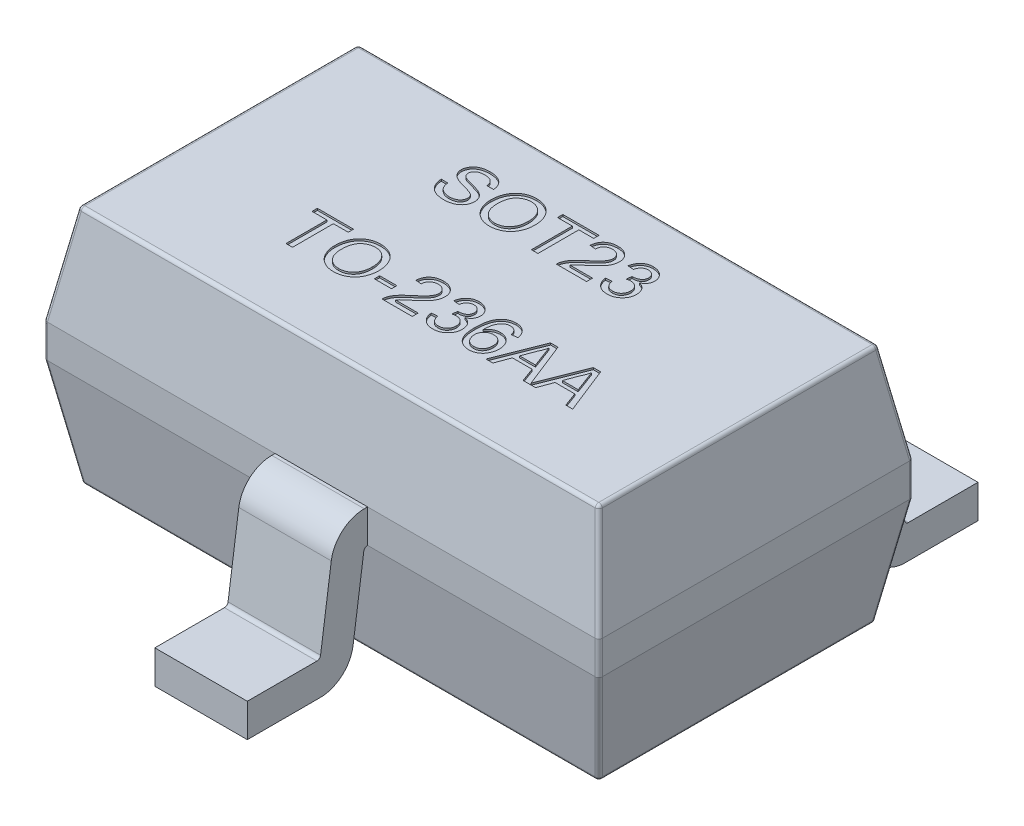
from build123d import *

# Parameters (mm, degrees)
SKETCH5_W                = 3
SKETCH5_H                = 1.7
BOSS_EXTRUDE3_DEPTH      = 0.585
BOSS_EXTRUDE3_DRAFT      = -10
SKETCH6_W                = 3
SKETCH6_H                = 1.7
BOSS_EXTRUDE4_DEPTH      = 0.18
SKETCH7_W                = 3
SKETCH7_H                = 1.7
BOSS_EXTRUDE5_DEPTH      = 0.535
BOSS_EXTRUDE5_TAPER      = 10
BOSS_EXTRUDE6_DEPTH      = 0.25
BOSS_EXTRUDE6_DEPTH_BACK = 0.25
BOSS_EXTRUDE8_DEPTH      = 0.25
LPATTERN2_COUNT          = 3
LPATTERN2_PITCH          = 0.95
SKETCH11_W               = 0.092948718
SKETCH11_H               = 0.028846154
CUT_EXTRUDE1_DEPTH       = 0.01
FILLET1_R                = 0.02


with BuildPart() as part:
    # Sketch5 → Boss-Extrude3 (with draft: the straight prism first)
    with BuildSketch(Plane(origin=(0, 0.585, 0), x_dir=(-1, 0, 0), z_dir=(0, 1, 0))):
        Rectangle(SKETCH5_W, SKETCH5_H)
    extrude(amount=-BOSS_EXTRUDE3_DEPTH)
    # Boss-Extrude3: the draft: its side faces are tilted about the plane it starts from
    boss_extrude3_sides = [part.faces().sort_by_distance(p)[0] for p in [
        (-1.5, 0.2925, 0),
        (0, 0.2925, 0.85),
        (1.5, 0.2925, 0),
        (0, 0.2925, -0.85),
    ]]
    draft(boss_extrude3_sides, Plane(origin=(0, 0.585, 0), x_dir=(-1, 0, 0), z_dir=(0, 1, 0)), BOSS_EXTRUDE3_DRAFT)

    # Sketch6 → Boss-Extrude4 (add)
    with BuildSketch(Plane(origin=(0, 0.585, 0), x_dir=(1, 0, 0), z_dir=(0, 1, 0))):
        Rectangle(SKETCH6_W, SKETCH6_H)
    extrude(amount=BOSS_EXTRUDE4_DEPTH)

    # Sketch7 → Boss-Extrude5 (add)
    with BuildSketch(Plane(origin=(0, 0.765, 0), x_dir=(1, 0, 0), z_dir=(0, 1, 0))):
        Rectangle(SKETCH7_W, SKETCH7_H)
    extrude(amount=BOSS_EXTRUDE5_DEPTH, taper=BOSS_EXTRUDE5_TAPER)

    # Sketch8 → Boss-Extrude6 (add, two sides: drawn at the far end of the back side and taken through both)
    with BuildSketch(Plane(origin=(0, 0, 0), x_dir=(0, 0, -1), z_dir=(1, 0, 0)).offset(-BOSS_EXTRUDE6_DEPTH_BACK)):
        with BuildLine():
            Line((-0.85, 0.765), (-0.85, 0.585))
            ThreePointArc((-0.85, 0.585), (-0.863519058, 0.580094192), (-0.870203238, 0.567783462))
            Line((-0.870203238, 0.567783462), (-0.92822336, 0.154948842))
            ThreePointArc((-0.92822336, 0.154948842), (-0.988380988, 0.044152276), (-1.106471613, 0))
            Line((-1.106471613, 0), (-1.5, 0))
            Line((-1.5, 0), (-1.5, 0.18))
            Line((-1.5, 0.18), (-1.123857348, 0.18))
            ThreePointArc((-1.123857348, 0.18), (-1.110736167, 0.184905808), (-1.104051986, 0.197216538))
            Line((-1.104051986, 0.197216538), (-1.046031864, 0.610051158))
            ThreePointArc((-1.046031864, 0.610051158), (-0.985874237, 0.720847724), (-0.867783612, 0.765))
            Line((-0.867783612, 0.765), (-0.85, 0.765))
        make_face()
    extrude(amount=BOSS_EXTRUDE6_DEPTH + BOSS_EXTRUDE6_DEPTH_BACK)

    # Sketch10 → Boss-Extrude8 (add, symmetric)
    with BuildSketch(Plane(origin=(0.95, 0, 0), x_dir=(0, 0, -1), z_dir=(1, 0, 0))):
        with BuildLine():
            Line((0.85, 0.585), (0.85, 0.765))
            Line((0.85, 0.765), (0.867783612, 0.765))
            ThreePointArc((0.867783612, 0.765), (0.985874237, 0.720847724), (1.046031864, 0.610051158))
            Line((1.046031864, 0.610051158), (1.104051986, 0.197216538))
            ThreePointArc((1.104051986, 0.197216538), (1.110736167, 0.184905808), (1.123857348, 0.18))
            Line((1.123857348, 0.18), (1.5, 0.18))
            Line((1.5, 0.18), (1.5, 0))
            Line((1.5, 0), (1.106471613, 0))
            ThreePointArc((1.106471613, 0), (0.988380988, 0.044152276), (0.92822336, 0.154948842))
            Line((0.92822336, 0.154948842), (0.870203238, 0.567783462))
            ThreePointArc((0.870203238, 0.567783462), (0.863519058, 0.580094192), (0.85, 0.585))
        make_face()
    boss_extrude8 = extrude(amount=BOSS_EXTRUDE8_DEPTH, both=True)

    # LPattern2: Boss-Extrude8 ×3, 1 skipped
    with Locations(*[(-i * LPATTERN2_PITCH, 0, 0) for i in range(1, LPATTERN2_COUNT) if i not in (1,)]):
        add(boss_extrude8)

    # Sketch11 → Cut-Extrude1 (cut)
    # profile 1 of 13: a face of its own
    with BuildSketch(Plane(origin=(0, 1.3, 0), x_dir=(1, 0, 0), z_dir=(0, 1, 0))):
        with BuildLine():
            Line((-0.549651855, 0.34836558), (-0.514395444, 0.34836558))
            add(Edge.make_bspline(
                [(-0.514395444, 0.34836558), (-0.514007644, 0.345200039), (-0.51326266, 0.339118865), (-0.511179608, 0.330499715), (-0.508498585, 0.322750216), (-0.505158106, 0.315767516), (-0.500763832, 0.309635338), (-0.495469488, 0.304104208), (-0.489039795, 0.299314583), (-0.481782138, 0.295052132), (-0.473699133, 0.291705433), (-0.465069804, 0.28922447), (-0.455935306, 0.28775448), (-0.449680564, 0.287564931), (-0.446486791, 0.287468144)],
                knots=[0, 0, 0, 0, 1.125557648, 2.162256852, 3.1243583, 4.018160113, 4.88511607, 5.777380551, 6.711250965, 7.707237736, 8.743031335, 9.791730543, 10.872421559, 12, 12, 12, 12], degree=3))
            add(Edge.make_bspline(
                [(-0.446486791, 0.287468144), (-0.443660576, 0.287520454), (-0.438150005, 0.287622449), (-0.430178348, 0.288847659), (-0.422676996, 0.290585587), (-0.415785557, 0.293214475), (-0.409529452, 0.296406769), (-0.404096725, 0.300267924), (-0.399458552, 0.304622245), (-0.395826527, 0.309584425), (-0.39297328, 0.314783959), (-0.390880128, 0.320128544), (-0.389633281, 0.325588514), (-0.3894744, 0.329262264), (-0.389395444, 0.331087936)],
                knots=[0, 0, 0, 0, 1.267006637, 2.470417599, 3.611360613, 4.716023143, 5.771382139, 6.754486395, 7.697536124, 8.612899418, 9.501261124, 10.352596716, 11.181322154, 12, 12, 12, 12], degree=3))
            add(Edge.make_bspline(
                [(-0.389395444, 0.331087936), (-0.38947985, 0.332895114), (-0.38964482, 0.336427242), (-0.390719884, 0.34156958), (-0.392763195, 0.346276312), (-0.395414626, 0.350739546), (-0.39910322, 0.354820207), (-0.403763342, 0.358580172), (-0.409497665, 0.361988992), (-0.413777476, 0.363855861), (-0.416038073, 0.364841942)],
                knots=[0, 0, 0, 0, 0.942140154, 1.841411588, 2.718743672, 3.605002079, 4.535543111, 5.568170452, 6.715506882, 8, 8, 8, 8], degree=3))
            add(Edge.make_bspline(
                [(-0.416038073, 0.364841942), (-0.416918835, 0.365203378), (-0.418908636, 0.366019926), (-0.422319062, 0.367100897), (-0.426365965, 0.368498701), (-0.431146568, 0.369938212), (-0.436635278, 0.371461014), (-0.442822957, 0.373184595), (-0.449706148, 0.375017528), (-0.457089631, 0.376968486), (-0.464544699, 0.378952311), (-0.471667145, 0.380937994), (-0.478220135, 0.382953717), (-0.484257345, 0.38489458), (-0.489747651, 0.38684345), (-0.494706637, 0.388746971), (-0.499140483, 0.390566524), (-0.501848508, 0.391904413), (-0.503127416, 0.392536253)],
                knots=[0, 0, 0, 0, 0.499201778, 1.127787504, 1.87543728, 2.745208432, 3.745951656, 4.863402235, 6.114490242, 7.482339553, 8.869366102, 10.161191451, 11.360587006, 12.46547846, 13.487450326, 14.41601931, 15.251940103, 16, 16, 16, 16], degree=3))
            add(Edge.make_bspline(
                [(-0.503127416, 0.392536253), (-0.506069825, 0.394125827), (-0.511749441, 0.397194119), (-0.519393575, 0.402680234), (-0.525834534, 0.408768094), (-0.531045144, 0.415448871), (-0.535128496, 0.422609578), (-0.537883515, 0.430262387), (-0.539770476, 0.438268386), (-0.539946818, 0.443773765), (-0.54003647, 0.446572711)],
                knots=[0, 0, 0, 0, 1.158441928, 2.236094408, 3.251151369, 4.220012324, 5.163146324, 6.095083285, 7.031536583, 8, 8, 8, 8], degree=3))
            add(Edge.make_bspline(
                [(-0.54003647, 0.446572711), (-0.539917484, 0.449672071), (-0.53968082, 0.455836675), (-0.537581488, 0.464882847), (-0.534233012, 0.47358767), (-0.53042143, 0.480498558), (-0.526704296, 0.48572454), (-0.523622763, 0.489488196), (-0.520166221, 0.492967191), (-0.51644112, 0.496210088), (-0.512380869, 0.499168435), (-0.508086204, 0.501963815), (-0.503401682, 0.504366512), (-0.496819232, 0.507424603), (-0.488013499, 0.510478392), (-0.476928184, 0.513139383), (-0.465261253, 0.514706385), (-0.457308799, 0.514922089), (-0.453247608, 0.515032246)],
                knots=[0, 0, 0, 0, 1.199927478, 2.386647047, 3.578628709, 4.806592355, 5.433127754, 6.062729195, 6.689531802, 7.331674828, 7.974827539, 8.635320743, 9.315455226, 10.01318112, 11.447700238, 12.918145351, 14.426146008, 16, 16, 16, 16], degree=3))
            add(Edge.make_bspline(
                [(-0.453247608, 0.515032246), (-0.448802364, 0.51493039), (-0.440146618, 0.514732057), (-0.427569575, 0.513081961), (-0.415838636, 0.510248312), (-0.406638831, 0.507076326), (-0.399837524, 0.503865121), (-0.395005685, 0.50135945), (-0.390520783, 0.498462437), (-0.386342446, 0.495327417), (-0.38243186, 0.49195582), (-0.378889539, 0.488267448), (-0.375561663, 0.484388141), (-0.371650945, 0.478818671), (-0.367434362, 0.471447509), (-0.363788552, 0.461897875), (-0.361283838, 0.451819022), (-0.360796614, 0.444851252), (-0.360549291, 0.441314298)],
                knots=[0, 0, 0, 0, 1.607600973, 3.130308851, 4.577334065, 5.967726088, 6.640410691, 7.296826776, 7.935019992, 8.569057421, 9.185393759, 9.8003086, 10.417295362, 11.032210203, 12.259799365, 13.477607022, 14.719591916, 16, 16, 16, 16], degree=3))
            Line((-0.360549291, 0.441314298), (-0.395805701, 0.441314298))
            add(Edge.make_bspline(
                [(-0.395805701, 0.441314298), (-0.396029715, 0.443104454), (-0.396468044, 0.446607258), (-0.39755548, 0.451678095), (-0.399079847, 0.45638766), (-0.400865348, 0.460779873), (-0.403029748, 0.464809051), (-0.405552813, 0.468513881), (-0.408465268, 0.471850716), (-0.411692172, 0.474907726), (-0.415331719, 0.477569529), (-0.419365208, 0.479880055), (-0.423799449, 0.481831921), (-0.428630534, 0.483430563), (-0.433859419, 0.484670087), (-0.439497999, 0.485581905), (-0.445544093, 0.486048888), (-0.449707943, 0.486139552), (-0.451845364, 0.486186093)],
                knots=[0, 0, 0, 0, 1.074487479, 2.102453544, 3.083708351, 4.020042547, 4.923259678, 5.803182661, 6.684453325, 7.556870173, 8.445961597, 9.363679789, 10.320905216, 11.327237703, 12.390948353, 13.519046902, 14.726457512, 16, 16, 16, 16], degree=3))
            add(Edge.make_bspline(
                [(-0.451845364, 0.486186093), (-0.454067114, 0.486169346), (-0.458367874, 0.486136929), (-0.46458511, 0.485546006), (-0.470347685, 0.484735238), (-0.4756457, 0.483539287), (-0.480461799, 0.481973783), (-0.484867462, 0.480165985), (-0.488739389, 0.477875033), (-0.492167843, 0.475323211), (-0.495125319, 0.47249976), (-0.497674225, 0.469524525), (-0.499928535, 0.466484922), (-0.501680184, 0.463214802), (-0.50310629, 0.459838011), (-0.504026285, 0.456291076), (-0.504677663, 0.452639606), (-0.504745456, 0.450148134), (-0.50478006, 0.448876397)],
                knots=[0, 0, 0, 0, 1.464176581, 2.834285765, 4.113735764, 5.29917439, 6.409476712, 7.449999357, 8.431575861, 9.367089851, 10.262376129, 11.120706676, 11.948504824, 12.751342953, 13.560717798, 14.359016663, 15.162382702, 16, 16, 16, 16], degree=3))
            add(Edge.make_bspline(
                [(-0.50478006, 0.448876397), (-0.504688949, 0.446725507), (-0.504512111, 0.442550828), (-0.502706339, 0.436619867), (-0.499929048, 0.431213411), (-0.497192975, 0.428271787), (-0.495815717, 0.426791061)],
                knots=[0, 0, 0, 0, 1.050964922, 2.039826012, 3.013306874, 4, 4, 4, 4], degree=3))
            add(Edge.make_bspline(
                [(-0.495815717, 0.426791061), (-0.494947508, 0.426051064), (-0.493027518, 0.424414609), (-0.489455081, 0.422248951), (-0.485025789, 0.420060831), (-0.479710046, 0.417885669), (-0.473516998, 0.415697061), (-0.466456634, 0.41344362), (-0.458502063, 0.411205531), (-0.4498957, 0.409048763), (-0.441201266, 0.406883324), (-0.432938631, 0.404726138), (-0.425352133, 0.402681719), (-0.418453809, 0.400687724), (-0.41223652, 0.39874979), (-0.406721871, 0.396827315), (-0.401865249, 0.395059126), (-0.398889994, 0.39381506), (-0.397508425, 0.393237375)],
                knots=[0, 0, 0, 0, 0.523891492, 1.158553688, 1.913783773, 2.794766643, 3.797521443, 4.933638669, 6.202080764, 7.596537849, 9.013317056, 10.322179469, 11.523240428, 12.626146501, 13.623953177, 14.517289671, 15.311498917, 16, 16, 16, 16], degree=3))
            add(Edge.make_bspline(
                [(-0.397508425, 0.393237375), (-0.395710934, 0.392408616), (-0.39218276, 0.390781901), (-0.38718463, 0.38800453), (-0.382520831, 0.385120381), (-0.378229046, 0.3820518), (-0.374323151, 0.378792335), (-0.370759474, 0.375379331), (-0.367516491, 0.37183197), (-0.364725057, 0.368036716), (-0.362218636, 0.36414699), (-0.36002535, 0.360108428), (-0.358259358, 0.35589728), (-0.356710474, 0.351564308), (-0.355596381, 0.347061316), (-0.354722708, 0.342433787), (-0.354213109, 0.337659971), (-0.354163939, 0.334427795), (-0.354139034, 0.33279066)],
                knots=[0, 0, 0, 0, 1.198900896, 2.353241543, 3.461831299, 4.520043694, 5.547003373, 6.541368882, 7.508191797, 8.454912692, 9.392021408, 10.310662301, 11.235020644, 12.156274873, 13.095836685, 14.042125239, 15.00831306, 16, 16, 16, 16], degree=3))
            add(Edge.make_bspline(
                [(-0.354139034, 0.33279066), (-0.354269504, 0.329523382), (-0.354528531, 0.32303675), (-0.356758846, 0.313475154), (-0.360262552, 0.304210022), (-0.364371515, 0.296857628), (-0.368255728, 0.291241468), (-0.371518649, 0.287204829), (-0.375137041, 0.283472341), (-0.379021824, 0.279927073), (-0.383203157, 0.276641358), (-0.387716293, 0.27361408), (-0.392513598, 0.270813723), (-0.399364028, 0.267401324), (-0.408462538, 0.263831631), (-0.420052213, 0.260858912), (-0.432266326, 0.258930435), (-0.44065329, 0.258726226), (-0.444934307, 0.25862199)],
                knots=[0, 0, 0, 0, 1.197055466, 2.376552968, 3.581957237, 4.820753935, 5.454298064, 6.085440993, 6.72202542, 7.359198513, 8.013298489, 8.67051481, 9.351020706, 10.049282741, 11.476266879, 12.925760103, 14.430794493, 16, 16, 16, 16], degree=3))
            add(Edge.make_bspline(
                [(-0.444934307, 0.25862199), (-0.447656265, 0.258644453), (-0.452988194, 0.258688454), (-0.460822868, 0.259221327), (-0.468330979, 0.259992152), (-0.475505159, 0.261140306), (-0.48232291, 0.262646621), (-0.488808706, 0.264455414), (-0.49497792, 0.266538612), (-0.500808995, 0.268988418), (-0.506286711, 0.271834824), (-0.511509562, 0.274905375), (-0.516392177, 0.27838599), (-0.520944836, 0.282221974), (-0.525282892, 0.286302511), (-0.529226545, 0.290794245), (-0.532909871, 0.295565822), (-0.536248707, 0.300660913), (-0.539231448, 0.306012858), (-0.541913782, 0.311531777), (-0.544173686, 0.317257705), (-0.545994953, 0.323161703), (-0.547537659, 0.329204262), (-0.54860749, 0.335435796), (-0.549394065, 0.341836741), (-0.549565417, 0.346176446), (-0.549651855, 0.34836558)],
                knots=[0, 0, 0, 0, 1.259822038, 2.467811403, 3.633536148, 4.752793854, 5.829021491, 6.863980041, 7.868367876, 8.841470325, 9.788447787, 10.724101269, 11.643985084, 12.560193707, 13.478453146, 14.398077254, 15.323914234, 16.266973849, 17.21495974, 18.158525798, 19.105629373, 20.061269543, 21.017128399, 21.990322895, 22.986232211, 24, 24, 24, 24], degree=3))
        make_face()
    # profile 2 of 13: a face of its own
    with BuildSketch(Plane(origin=(0, 1.3, 0), x_dir=(1, 0, 0), z_dir=(0, 1, 0))):
        with BuildLine():
            add(Edge.make_bspline(
                [(-0.318882624, 0.38352183), (-0.318795733, 0.388534114), (-0.318626432, 0.398300297), (-0.317044557, 0.412521116), (-0.314475998, 0.425901047), (-0.310804015, 0.438439048), (-0.306149766, 0.450154764), (-0.300491638, 0.461074725), (-0.293659438, 0.471075324), (-0.285930478, 0.480251762), (-0.277297584, 0.488364405), (-0.268106007, 0.495569594), (-0.258240971, 0.501579574), (-0.247793622, 0.506541836), (-0.236719574, 0.510351717), (-0.225049919, 0.513018981), (-0.212797138, 0.514739625), (-0.204422075, 0.514933289), (-0.20014264, 0.515032246)],
                knots=[0, 0, 0, 0, 1.203621547, 2.345195544, 3.432004029, 4.472479546, 5.478447225, 6.455936844, 7.420185704, 8.381829745, 9.332027588, 10.260832629, 11.182364398, 12.100723901, 13.034044877, 13.989196293, 14.972532542, 16, 16, 16, 16], degree=3))
            add(Edge.make_bspline(
                [(-0.20014264, 0.515032246), (-0.197320058, 0.514982959), (-0.191714922, 0.514885083), (-0.183428228, 0.514140375), (-0.175354472, 0.512811201), (-0.167501607, 0.511029959), (-0.159848255, 0.508693048), (-0.152389847, 0.505934394), (-0.145191672, 0.502516034), (-0.138205844, 0.49868884), (-0.131514823, 0.494407958), (-0.12522662, 0.489678876), (-0.119356294, 0.48453736), (-0.113824993, 0.479067923), (-0.108817287, 0.473085979), (-0.104126296, 0.466773747), (-0.099886818, 0.460019303), (-0.09608381, 0.452877987), (-0.092683535, 0.445460096), (-0.089777343, 0.437734885), (-0.08728185, 0.429795023), (-0.085192911, 0.421593516), (-0.083694041, 0.413133167), (-0.082500474, 0.40445043), (-0.081872267, 0.395516929), (-0.081759989, 0.389482189), (-0.081703137, 0.386426477)],
                knots=[0, 0, 0, 0, 1.034375294, 2.054082248, 3.045783978, 4.031219655, 5.002789406, 5.976610191, 6.94273282, 7.920236376, 8.894345378, 9.851183672, 10.800797181, 11.752517031, 12.698794154, 13.65688337, 14.632873302, 15.61821402, 16.620222298, 17.621258913, 18.640965868, 19.669244166, 20.720417492, 21.788124603, 22.880008887, 24, 24, 24, 24], degree=3))
            add(Edge.make_bspline(
                [(-0.081703137, 0.386426477), (-0.081755226, 0.383320376), (-0.081858137, 0.377183738), (-0.082554477, 0.368118046), (-0.083778884, 0.359312612), (-0.085402851, 0.350741178), (-0.087578918, 0.342421589), (-0.09016484, 0.334329993), (-0.093292657, 0.326514584), (-0.09682518, 0.318956525), (-0.100822228, 0.311759766), (-0.105231243, 0.304974631), (-0.110055349, 0.298664589), (-0.115221268, 0.292752231), (-0.120849638, 0.287343282), (-0.126871154, 0.282387164), (-0.133262662, 0.277837135), (-0.140045634, 0.273816425), (-0.147098342, 0.270292128), (-0.154281223, 0.267165443), (-0.161599613, 0.264498881), (-0.169078523, 0.262337897), (-0.176697552, 0.260704902), (-0.18443526, 0.259482099), (-0.192317011, 0.258778004), (-0.197620595, 0.258674262), (-0.20029288, 0.25862199)],
                knots=[0, 0, 0, 0, 1.141429366, 2.255090526, 3.338676798, 4.407031443, 5.458968682, 6.496860253, 7.526652771, 8.550250826, 9.560787671, 10.54935636, 11.521089193, 12.477323897, 13.431786008, 14.386110112, 15.340986122, 16.312041, 17.28047646, 18.236612773, 19.189437236, 20.140779471, 21.09494583, 22.051062463, 23.018000708, 24, 24, 24, 24], degree=3))
            add(Edge.make_bspline(
                [(-0.20029288, 0.25862199), (-0.20316618, 0.258664501), (-0.208857467, 0.258748704), (-0.217269343, 0.259589197), (-0.225471944, 0.260871397), (-0.233441425, 0.262722507), (-0.241166895, 0.265137411), (-0.248657496, 0.268060335), (-0.255939572, 0.271452214), (-0.262922765, 0.275410168), (-0.269583307, 0.279810989), (-0.275856642, 0.284632798), (-0.281739301, 0.28983116), (-0.287136891, 0.295491996), (-0.292224224, 0.3014101), (-0.296797884, 0.307805442), (-0.30100724, 0.314532985), (-0.304727731, 0.321657578), (-0.308088638, 0.328967505), (-0.310920275, 0.336465105), (-0.313408735, 0.344039883), (-0.315390541, 0.351738526), (-0.3169698, 0.359543277), (-0.318031736, 0.367441147), (-0.318798675, 0.3754439), (-0.3188545, 0.380815636), (-0.318882624, 0.38352183)],
                knots=[0, 0, 0, 0, 1.072727997, 2.12480551, 3.153819198, 4.171534612, 5.177148798, 6.173931848, 7.17235114, 8.174500385, 9.168706755, 10.151274001, 11.127173509, 12.097141049, 13.070188938, 14.039134204, 15.03036519, 16.031505612, 17.038625933, 18.033164522, 19.022845559, 20.014762458, 21.000193215, 21.994692725, 22.989758729, 24, 24, 24, 24], degree=3))
        make_face()
        with BuildLine():
            add(Edge.make_bspline(
                [(-0.283626214, 0.383121189), (-0.283572185, 0.379511892), (-0.283466833, 0.372474017), (-0.282261545, 0.36221317), (-0.280432714, 0.352531539), (-0.277911863, 0.343401944), (-0.274523223, 0.334914676), (-0.270471664, 0.32698818), (-0.265620771, 0.319675148), (-0.260077568, 0.312996037), (-0.25398068, 0.306996024), (-0.247465536, 0.301755332), (-0.240530672, 0.297366623), (-0.233252974, 0.293742807), (-0.225580168, 0.290914088), (-0.217535235, 0.288927833), (-0.209112264, 0.287685591), (-0.203368837, 0.287541529), (-0.200443121, 0.287468144)],
                knots=[0, 0, 0, 0, 1.215430442, 2.370003584, 3.475209778, 4.53279855, 5.55522989, 6.548792651, 7.526809858, 8.505409025, 9.467826767, 10.404123909, 11.316848639, 12.227335424, 13.138360512, 14.065900994, 15.014765094, 16, 16, 16, 16], degree=3))
            add(Edge.make_bspline(
                [(-0.200443121, 0.287468144), (-0.197467813, 0.287542615), (-0.19164217, 0.287688429), (-0.183092211, 0.288908984), (-0.174968794, 0.290986929), (-0.167191399, 0.293753143), (-0.159900636, 0.297492593), (-0.152925993, 0.301871469), (-0.146457601, 0.30722233), (-0.140336679, 0.313232955), (-0.134846624, 0.320065134), (-0.129975356, 0.327550568), (-0.126018281, 0.335801521), (-0.12260188, 0.344636235), (-0.120100195, 0.35422169), (-0.118251297, 0.364448918), (-0.117137111, 0.375350817), (-0.117019782, 0.382834769), (-0.116959547, 0.386676878)],
                knots=[0, 0, 0, 0, 0.976878588, 1.912725521, 2.8289017, 3.727303729, 4.617335839, 5.514666588, 6.426584173, 7.368641557, 8.327632997, 9.299405846, 10.294892156, 11.327373912, 12.405931897, 13.542618837, 14.738430195, 16, 16, 16, 16], degree=3))
            add(Edge.make_bspline(
                [(-0.116959547, 0.386676878), (-0.116980834, 0.389148641), (-0.117022591, 0.393997346), (-0.117575596, 0.401144392), (-0.118288901, 0.408069124), (-0.119374919, 0.414762606), (-0.120871589, 0.42119712), (-0.122529646, 0.427421652), (-0.124602988, 0.433382561), (-0.126955484, 0.439103224), (-0.129587886, 0.444554273), (-0.132556886, 0.449689753), (-0.135827978, 0.454489698), (-0.139312903, 0.459045111), (-0.143204638, 0.463179677), (-0.147315792, 0.467068045), (-0.151739751, 0.470629877), (-0.156432365, 0.473866107), (-0.161327063, 0.476779223), (-0.166413756, 0.479272472), (-0.171611403, 0.481462479), (-0.177007008, 0.483141211), (-0.182526067, 0.484495132), (-0.18819089, 0.485523562), (-0.194022505, 0.486056131), (-0.197954878, 0.486142461), (-0.199942319, 0.486186093)],
                knots=[0, 0, 0, 0, 1.220438779, 2.394059227, 3.538503547, 4.658058814, 5.74010225, 6.800155734, 7.837851593, 8.854470756, 9.853724944, 10.825214244, 11.781044712, 12.72106398, 13.654479919, 14.581868691, 15.514082315, 16.456304431, 17.39516604, 18.324312202, 19.252140633, 20.177768678, 21.111585046, 22.057694709, 23.018348693, 24, 24, 24, 24], degree=3))
            add(Edge.make_bspline(
                [(-0.199942319, 0.486186093), (-0.202751297, 0.486130307), (-0.208293723, 0.486020237), (-0.216452834, 0.484796634), (-0.224319102, 0.482968403), (-0.231904733, 0.480412439), (-0.239144851, 0.477027942), (-0.246076964, 0.472877319), (-0.252762606, 0.468073585), (-0.259096353, 0.462499698), (-0.265000791, 0.456096664), (-0.269992401, 0.448547682), (-0.274199467, 0.440032963), (-0.277712289, 0.43057409), (-0.280390712, 0.42009781), (-0.282241838, 0.408649208), (-0.2834106, 0.396216219), (-0.283552505, 0.387597791), (-0.283626214, 0.383121189)],
                knots=[0, 0, 0, 0, 0.895090134, 1.766112571, 2.624765742, 3.468151641, 4.313618154, 5.168136083, 6.041303099, 6.935189387, 7.854749729, 8.809996334, 9.809869957, 10.877771942, 12.021723904, 13.25217762, 14.572720513, 16, 16, 16, 16], degree=3))
        make_face(mode=Mode.SUBTRACT)
    # profile 3 of 13: a face of its own
    with BuildSketch(Plane(origin=(0, 1.3, 0), x_dir=(1, 0, 0), z_dir=(0, 1, 0))):
        Polygon((0.024066094, 0.261827118), (0.024066094, 0.482980964), (-0.056062111, 0.482980964), (-0.056062111, 0.511827118), (0.139450709, 0.511827118), (0.139450709, 0.482980964), (0.059322504, 0.482980964), (0.059322504, 0.261827118), align=None)
    # profile 4 of 13: a face of its own
    with BuildSketch(Plane(origin=(0, 1.3, 0), x_dir=(1, 0, 0), z_dir=(0, 1, 0))):
        with BuildLine():
            Line((0.322143017, 0.2938784), (0.322143017, 0.261827118))
            Line((0.322143017, 0.261827118), (0.158681479, 0.261827118))
            add(Edge.make_bspline(
                [(0.158681479, 0.261827118), (0.158678132, 0.263732016), (0.15867145, 0.267535427), (0.159315049, 0.27316043), (0.160323053, 0.278710813), (0.161462802, 0.282270053), (0.162036847, 0.284062695)],
                knots=[0, 0, 0, 0, 1.01057331, 2.01775941, 3.001627217, 4, 4, 4, 4], degree=3))
            add(Edge.make_bspline(
                [(0.162036847, 0.284062695), (0.163097491, 0.286991659), (0.165257137, 0.292955511), (0.169632602, 0.301560517), (0.174779183, 0.310113481), (0.179790103, 0.317076802), (0.184379025, 0.322640008), (0.188227434, 0.326992573), (0.192492176, 0.331447936), (0.197169837, 0.336005284), (0.202215396, 0.340694132), (0.207635738, 0.345530118), (0.213494869, 0.350423117), (0.217585156, 0.353666401), (0.219679075, 0.355326718)],
                knots=[0, 0, 0, 0, 1.204657718, 2.452881516, 3.728232997, 5.065887527, 5.768225529, 6.518857853, 7.313994055, 8.154655305, 9.046094665, 9.979688118, 10.965752482, 12, 12, 12, 12], degree=3))
            add(Edge.make_bspline(
                [(0.219679075, 0.355326718), (0.222895851, 0.358034226), (0.229089958, 0.363247706), (0.237837008, 0.370984026), (0.245826015, 0.378167637), (0.252929762, 0.384924448), (0.25920635, 0.39118892), (0.264670518, 0.396946862), (0.26936928, 0.402180303), (0.273245275, 0.407078672), (0.27651557, 0.411704096), (0.279286857, 0.41621591), (0.281596357, 0.420692928), (0.283519861, 0.425120982), (0.285041189, 0.42951901), (0.286078191, 0.433899823), (0.286781449, 0.438219954), (0.286851811, 0.441094618), (0.286886607, 0.442516221)],
                knots=[0, 0, 0, 0, 1.782554561, 3.432421876, 4.950675607, 6.337395053, 7.588547463, 8.709982106, 9.702713005, 10.569305638, 11.356701089, 12.103210377, 12.812277205, 13.490692607, 14.148717897, 14.782152033, 15.397739362, 16, 16, 16, 16], degree=3))
            add(Edge.make_bspline(
                [(0.286886607, 0.442516221), (0.286851807, 0.443921237), (0.286783531, 0.446677803), (0.286135734, 0.450712019), (0.28523395, 0.454597066), (0.283776038, 0.458263004), (0.282040684, 0.461818395), (0.279814674, 0.465150895), (0.277239637, 0.468343556), (0.274291439, 0.471312205), (0.271071315, 0.474097271), (0.267473287, 0.476412338), (0.26373367, 0.478496587), (0.259723451, 0.480172444), (0.255449147, 0.481403055), (0.250941873, 0.482296162), (0.246202343, 0.482862439), (0.242967948, 0.482940857), (0.24131369, 0.482980964)],
                knots=[0, 0, 0, 0, 0.988194508, 1.938783882, 2.870742509, 3.789494954, 4.709148727, 5.651055405, 6.603531303, 7.592354411, 8.592907906, 9.593461401, 10.59787167, 11.603930315, 12.645063138, 13.723588815, 14.835711238, 16, 16, 16, 16], degree=3))
            add(Edge.make_bspline(
                [(0.24131369, 0.482980964), (0.239575939, 0.482941056), (0.236175031, 0.482862951), (0.231203815, 0.482294415), (0.226484507, 0.481425769), (0.222028371, 0.480097683), (0.217840831, 0.478424622), (0.213938943, 0.476318683), (0.21026022, 0.473941458), (0.206920519, 0.471127004), (0.203900472, 0.468006348), (0.201219373, 0.464608898), (0.199022615, 0.460869089), (0.197208442, 0.456869153), (0.195749695, 0.452596514), (0.194690694, 0.44801851), (0.19411332, 0.443148357), (0.193997215, 0.439813279), (0.193937889, 0.43810917)],
                knots=[0, 0, 0, 0, 1.131143733, 2.213731411, 3.253917892, 4.251203413, 5.236093891, 6.184197493, 7.13373276, 8.082770301, 9.020476205, 9.957489029, 10.893177274, 11.836722509, 12.812818608, 13.827831385, 14.890097571, 16, 16, 16, 16], degree=3))
            Line((0.193937889, 0.43810917), (0.161886607, 0.441314298))
            add(Edge.make_bspline(
                [(0.161886607, 0.441314298), (0.162214537, 0.444107645), (0.162852497, 0.449541863), (0.164441568, 0.457412411), (0.16667248, 0.464734277), (0.169341954, 0.471609543), (0.172688392, 0.477921171), (0.176471252, 0.48379971), (0.18093296, 0.489058718), (0.185861964, 0.493863965), (0.191312267, 0.498098653), (0.19723267, 0.50179824), (0.203620467, 0.504892716), (0.210440078, 0.507454814), (0.217707161, 0.509398742), (0.225411435, 0.510792722), (0.23356529, 0.511651987), (0.239158118, 0.511767908), (0.242014812, 0.511827118)],
                knots=[0, 0, 0, 0, 1.130804643, 2.199883102, 3.223565206, 4.205909148, 5.160801384, 6.091796021, 7.01151579, 7.927798993, 8.855738875, 9.7815393, 10.730299821, 11.705391175, 12.706931101, 13.751121791, 14.851322166, 16, 16, 16, 16], degree=3))
            add(Edge.make_bspline(
                [(0.242014812, 0.511827118), (0.244905699, 0.511777615), (0.250537165, 0.511681183), (0.258743116, 0.510694485), (0.266485657, 0.509157712), (0.273793172, 0.507015922), (0.280622489, 0.504207395), (0.286978859, 0.500776011), (0.292891591, 0.496755239), (0.298261896, 0.492096815), (0.30310444, 0.487011364), (0.307348216, 0.481584092), (0.310896217, 0.475838184), (0.313917119, 0.46985196), (0.316157834, 0.463498936), (0.317733546, 0.456865483), (0.318804288, 0.449945931), (0.318892763, 0.445224704), (0.318937889, 0.442816702)],
                knots=[0, 0, 0, 0, 1.195390245, 2.328627238, 3.413424916, 4.457841177, 5.473507151, 6.462241215, 7.441013641, 8.425227782, 9.397253344, 10.342087291, 11.269524934, 12.186751184, 13.110685745, 14.048630397, 15.004728144, 16, 16, 16, 16], degree=3))
            add(Edge.make_bspline(
                [(0.318937889, 0.442816702), (0.318868983, 0.440342752), (0.318731018, 0.435389392), (0.317654188, 0.42798558), (0.315811719, 0.420662116), (0.313369098, 0.413329869), (0.310031968, 0.405959737), (0.305816071, 0.398450049), (0.30058579, 0.390773066), (0.295555727, 0.384246778), (0.290873554, 0.378776102), (0.286723251, 0.374273416), (0.281921589, 0.369489614), (0.276648699, 0.364259021), (0.270689526, 0.358767281), (0.26421529, 0.352849942), (0.257084269, 0.346662726), (0.25213395, 0.342435916), (0.249576911, 0.340252599)],
                knots=[0, 0, 0, 0, 0.927118007, 1.856282007, 2.79721255, 3.754929441, 4.749232485, 5.824981375, 6.979078785, 8.228161913, 8.911614355, 9.677694854, 10.522803217, 11.452009355, 12.461436787, 13.560019032, 14.739651695, 16, 16, 16, 16], degree=3))
            add(Edge.make_bspline(
                [(0.249576911, 0.340252599), (0.247387194, 0.338469936), (0.24321174, 0.335070671), (0.237271347, 0.330142666), (0.231950563, 0.325623818), (0.22712496, 0.321661525), (0.222970284, 0.318064135), (0.219340193, 0.314989198), (0.21636657, 0.312282108), (0.211838268, 0.308169982), (0.206102787, 0.302308563), (0.20187664, 0.296613186), (0.199847344, 0.2938784)],
                knots=[0, 0, 0, 0, 1.241996727, 2.368296581, 3.394949853, 4.3125351, 5.114548721, 5.812230366, 6.404953749, 6.883082049, 8.503329734, 10, 10, 10, 10], degree=3))
            Line((0.199847344, 0.2938784), (0.322143017, 0.2938784))
        make_face()
    # profile 5 of 13: a face of its own
    with BuildSketch(Plane(origin=(0, 1.3, 0), x_dir=(1, 0, 0), z_dir=(0, 1, 0))):
        with BuildLine():
            Line((0.357399427, 0.329134811), (0.389450709, 0.332339939))
            add(Edge.make_bspline(
                [(0.389450709, 0.332339939), (0.389877991, 0.330414108), (0.39070475, 0.326687768), (0.392295536, 0.321349399), (0.393975754, 0.316394199), (0.396058711, 0.311933004), (0.398091224, 0.307783369), (0.400479735, 0.304116753), (0.403031906, 0.30083749), (0.405794916, 0.297957756), (0.408800606, 0.295477953), (0.412008903, 0.293307992), (0.415487659, 0.291495783), (0.419210239, 0.290060954), (0.423145292, 0.288899449), (0.427314202, 0.288046576), (0.431739013, 0.287538509), (0.434771862, 0.287491982), (0.436325709, 0.287468144)],
                knots=[0, 0, 0, 0, 1.321063709, 2.556160278, 3.730472002, 4.821700466, 5.852032229, 6.822994757, 7.746964065, 8.632786469, 9.490489437, 10.352773447, 11.223141997, 12.11199479, 13.021433979, 13.96892724, 14.959401504, 16, 16, 16, 16], degree=3))
            add(Edge.make_bspline(
                [(0.436325709, 0.287468144), (0.438148318, 0.28749413), (0.441707875, 0.287544881), (0.446894737, 0.288306334), (0.45183095, 0.289351883), (0.456446089, 0.290991363), (0.460804417, 0.292995111), (0.464881103, 0.295471318), (0.468704053, 0.298379005), (0.472197861, 0.301737949), (0.475322365, 0.305432896), (0.478105175, 0.309335702), (0.480406185, 0.31347967), (0.48234559, 0.31780643), (0.483777124, 0.322385902), (0.484825123, 0.32716098), (0.485509996, 0.332153261), (0.485572603, 0.335559466), (0.485604556, 0.337297871)],
                knots=[0, 0, 0, 0, 1.111377895, 2.170522867, 3.193923215, 4.186422864, 5.152846954, 6.117443035, 7.091571248, 8.078879332, 9.069127402, 10.041602243, 10.999610288, 11.957618333, 12.930786866, 13.922135183, 14.939532534, 16, 16, 16, 16], degree=3))
            add(Edge.make_bspline(
                [(0.485604556, 0.337297871), (0.485567002, 0.338952229), (0.485493531, 0.342188848), (0.484889543, 0.346939511), (0.483835596, 0.351449171), (0.482374574, 0.355743928), (0.480507688, 0.359817476), (0.478263745, 0.3637035), (0.47551922, 0.367316838), (0.472430014, 0.3706963), (0.469060592, 0.373809755), (0.465373277, 0.376458148), (0.461492836, 0.378743798), (0.457373023, 0.380589371), (0.453030944, 0.382054213), (0.448470737, 0.383107023), (0.443670478, 0.383711274), (0.440400602, 0.383784757), (0.438729556, 0.383822311)],
                knots=[0, 0, 0, 0, 1.072815875, 2.098878726, 3.09954706, 4.07199174, 5.036203424, 6.001873089, 6.97636515, 7.972747947, 8.969130744, 9.945905975, 10.911575641, 11.885646534, 12.868345115, 13.879560892, 14.916365174, 16, 16, 16, 16], degree=3))
            add(Edge.make_bspline(
                [(0.438729556, 0.383822311), (0.437258301, 0.383783332), (0.434135955, 0.383700612), (0.429207849, 0.382970219), (0.423749136, 0.381947497), (0.41997701, 0.380943847), (0.417996383, 0.380416862)],
                knots=[0, 0, 0, 0, 0.837610211, 1.777604146, 2.833088267, 4, 4, 4, 4], degree=3))
            Line((0.417996383, 0.380416862), (0.421301671, 0.409263016))
            add(Edge.make_bspline(
                [(0.421301671, 0.409263016), (0.422168901, 0.409168251), (0.423700999, 0.409000835), (0.425240823, 0.408939201), (0.425909043, 0.408912455)],
                knots=[0, 0, 0, 0, 1.132082448, 2, 2, 2, 2], degree=3))
            add(Edge.make_bspline(
                [(0.425909043, 0.408912455), (0.428856699, 0.409024995), (0.434639075, 0.409245764), (0.443068658, 0.411080168), (0.45105743, 0.413968379), (0.457229272, 0.417414433), (0.461806102, 0.420655634), (0.464692159, 0.423578037), (0.467294088, 0.426679297), (0.46923534, 0.430236554), (0.470912462, 0.434016225), (0.471951016, 0.438167202), (0.472708414, 0.442588586), (0.472758381, 0.445650956), (0.472784043, 0.447223753)],
                knots=[0, 0, 0, 0, 1.557468908, 3.055264441, 4.54122591, 6.035034992, 6.780215604, 7.498173296, 8.201377046, 8.913174237, 9.633083494, 10.382644491, 11.169345745, 12, 12, 12, 12], degree=3))
            add(Edge.make_bspline(
                [(0.472784043, 0.447223753), (0.472760358, 0.448494154), (0.472714039, 0.450978699), (0.472198015, 0.454621305), (0.471344576, 0.458072786), (0.470191068, 0.461369995), (0.468679281, 0.464495652), (0.466804546, 0.467445929), (0.464662598, 0.470280677), (0.462134104, 0.472853413), (0.459426307, 0.47526883), (0.456440463, 0.477303107), (0.453318678, 0.479110262), (0.449950852, 0.480475846), (0.446420129, 0.481598578), (0.442696329, 0.482385343), (0.438778091, 0.482913708), (0.436093817, 0.48295823), (0.434723145, 0.482980964)],
                knots=[0, 0, 0, 0, 1.041493611, 2.036867705, 3.009952345, 3.954088258, 4.897230656, 5.850851638, 6.817653571, 7.805463921, 8.805067469, 9.788883576, 10.763797054, 11.758134544, 12.762883247, 13.799594994, 14.876406454, 16, 16, 16, 16], degree=3))
            add(Edge.make_bspline(
                [(0.434723145, 0.482980964), (0.432040775, 0.482876374), (0.426860721, 0.482674396), (0.419444355, 0.480805672), (0.412723789, 0.477781834), (0.407748206, 0.474235717), (0.404215104, 0.470845428), (0.401801808, 0.467971767), (0.399643252, 0.464798408), (0.397733318, 0.46132648), (0.396097809, 0.457542023), (0.394623443, 0.453491918), (0.393482147, 0.449111325), (0.392935943, 0.446076006), (0.392655838, 0.444519426)],
                knots=[0, 0, 0, 0, 1.533565899, 2.961543033, 4.347411787, 5.731829577, 6.434842101, 7.147085226, 7.87612511, 8.629021686, 9.412189982, 10.234506416, 11.094615066, 12, 12, 12, 12], degree=3))
            Line((0.392655838, 0.444519426), (0.360604556, 0.447724554))
            add(Edge.make_bspline(
                [(0.360604556, 0.447724554), (0.361105933, 0.450202794), (0.362089425, 0.455064057), (0.364093118, 0.462085045), (0.366536598, 0.468675754), (0.369470405, 0.474805966), (0.372755938, 0.480549045), (0.376546039, 0.48583687), (0.380751848, 0.490700877), (0.385380837, 0.495126231), (0.390370164, 0.499078567), (0.395694699, 0.502487976), (0.401310746, 0.505377941), (0.407223562, 0.507707764), (0.413428467, 0.509602263), (0.419943113, 0.510857374), (0.426738013, 0.511706392), (0.431365062, 0.511786381), (0.433721543, 0.511827118)],
                knots=[0, 0, 0, 0, 1.136581168, 2.229493434, 3.279335563, 4.293305329, 5.282068175, 6.250623624, 7.213783178, 8.169396253, 9.125981663, 10.071280146, 11.007896369, 11.961295906, 12.925420184, 13.920544621, 14.940967302, 16, 16, 16, 16], degree=3))
            add(Edge.make_bspline(
                [(0.433721543, 0.511827118), (0.436983473, 0.511721342), (0.443397483, 0.511513351), (0.452818169, 0.509861465), (0.461829005, 0.507150687), (0.470357482, 0.503393065), (0.478256872, 0.498801351), (0.485247182, 0.49329846), (0.491234959, 0.486979593), (0.496103905, 0.479913832), (0.499959427, 0.472390908), (0.502812398, 0.464581787), (0.50451709, 0.456495458), (0.504729031, 0.451021016), (0.504835325, 0.448275436)],
                knots=[0, 0, 0, 0, 1.104647871, 2.172094857, 3.229560912, 4.285649672, 5.322588163, 6.317201348, 7.289435229, 8.260615662, 9.214246199, 10.146367077, 11.070353327, 12, 12, 12, 12], degree=3))
            add(Edge.make_bspline(
                [(0.504835325, 0.448275436), (0.504727564, 0.445680047), (0.504514796, 0.440555577), (0.50287673, 0.433062695), (0.500108725, 0.425964031), (0.496367422, 0.41923468), (0.49151587, 0.413020169), (0.485567394, 0.407482474), (0.478617155, 0.402568607), (0.473408538, 0.400010993), (0.470730758, 0.398696109)],
                knots=[0, 0, 0, 0, 0.975609618, 1.926294443, 2.868398979, 3.832526731, 4.812148358, 5.820404151, 6.879456693, 8, 8, 8, 8], degree=3))
            add(Edge.make_bspline(
                [(0.470730758, 0.398696109), (0.472526031, 0.398242838), (0.476042448, 0.397355012), (0.48109282, 0.395515462), (0.485840736, 0.393361812), (0.490349389, 0.39092255), (0.494487883, 0.388037728), (0.49839887, 0.384883501), (0.501934504, 0.381307961), (0.50519722, 0.377438546), (0.50816589, 0.37331575), (0.510664056, 0.368859375), (0.5128199, 0.364186572), (0.514658198, 0.359263449), (0.515979196, 0.354052045), (0.516923751, 0.348592732), (0.51754708, 0.342904479), (0.51761923, 0.339018942), (0.517655838, 0.337047471)],
                knots=[0, 0, 0, 0, 1.053251915, 2.063013066, 3.05373318, 4.018979697, 4.975584284, 5.920798056, 6.874756953, 7.832116109, 8.799604348, 9.761196922, 10.734637845, 11.72654167, 12.747371341, 13.789206138, 14.878271633, 16, 16, 16, 16], degree=3))
            add(Edge.make_bspline(
                [(0.517655838, 0.337047471), (0.517594836, 0.334355938), (0.517474947, 0.329066213), (0.516338401, 0.321295486), (0.514481029, 0.313850085), (0.511910675, 0.306704727), (0.50865363, 0.29983025), (0.504566576, 0.293323664), (0.499770643, 0.287132081), (0.49434081, 0.281314782), (0.488391909, 0.275968505), (0.481931629, 0.27133914), (0.475087788, 0.267407811), (0.467849247, 0.264201831), (0.460235197, 0.261683039), (0.452238062, 0.259877489), (0.443833096, 0.258816349), (0.438098262, 0.258687629), (0.435173867, 0.25862199)],
                knots=[0, 0, 0, 0, 1.016055063, 1.996874249, 2.958724482, 3.910019225, 4.860394196, 5.826121543, 6.806008102, 7.814207964, 8.82789325, 9.821757317, 10.810247154, 11.803791187, 12.806673825, 13.834534493, 14.895752369, 16, 16, 16, 16], degree=3))
            add(Edge.make_bspline(
                [(0.435173867, 0.25862199), (0.432549464, 0.258671423), (0.427382908, 0.25876874), (0.419820137, 0.259782617), (0.412574609, 0.261221424), (0.405703618, 0.263439518), (0.399127351, 0.266144449), (0.392957186, 0.269604999), (0.387082179, 0.273577577), (0.381612626, 0.278175679), (0.376578903, 0.283250783), (0.372088219, 0.288727821), (0.368232038, 0.294594635), (0.364832059, 0.300763445), (0.362083997, 0.307350537), (0.359944195, 0.314299355), (0.358312568, 0.321584112), (0.357707119, 0.326590526), (0.357399427, 0.329134811)],
                knots=[0, 0, 0, 0, 1.08471039, 2.135426191, 3.150939737, 4.135689946, 5.116584603, 6.086901885, 7.055842759, 8.045878862, 9.036901429, 10.008421467, 10.96965771, 11.936653536, 12.917548193, 13.915472582, 14.940632654, 16, 16, 16, 16], degree=3))
        make_face()
    # profile 6 of 13: a face of its own
    with BuildSketch(Plane(origin=(0, 1.3, 0), x_dir=(1, 0, 0), z_dir=(0, 1, 0))):
        Polygon((-0.668241598, -0.372788266), (-0.668241598, -0.15163442), (-0.748369803, -0.15163442), (-0.748369803, -0.122788266), (-0.552856983, -0.122788266), (-0.552856983, -0.15163442), (-0.632985188, -0.15163442), (-0.632985188, -0.372788266), align=None)
    # profile 7 of 13: a face of its own
    with BuildSketch(Plane(origin=(0, 1.3, 0), x_dir=(1, 0, 0), z_dir=(0, 1, 0))):
        with BuildLine():
            add(Edge.make_bspline(
                [(-0.527215957, -0.251093555), (-0.527129067, -0.24608127), (-0.526959765, -0.236315088), (-0.52537789, -0.222094268), (-0.522809331, -0.208714337), (-0.519137348, -0.196176337), (-0.5144831, -0.184460621), (-0.508824972, -0.17354066), (-0.501992771, -0.16354006), (-0.494263811, -0.154363623), (-0.485630918, -0.14625098), (-0.47643934, -0.13904579), (-0.466574304, -0.13303581), (-0.456126955, -0.128073548), (-0.445052907, -0.124263667), (-0.433383252, -0.121596404), (-0.421130471, -0.11987576), (-0.412755408, -0.119682095), (-0.408475973, -0.119583138)],
                knots=[0, 0, 0, 0, 1.203621547, 2.345195544, 3.432004029, 4.472479546, 5.478447225, 6.455936844, 7.420185704, 8.381829745, 9.332027588, 10.260832629, 11.182364398, 12.100723901, 13.034044877, 13.989196293, 14.972532542, 16, 16, 16, 16], degree=3))
            add(Edge.make_bspline(
                [(-0.408475973, -0.119583138), (-0.405653392, -0.119632426), (-0.400048255, -0.119730302), (-0.391761561, -0.120475009), (-0.383687806, -0.121804183), (-0.37583494, -0.123585425), (-0.368181588, -0.125922337), (-0.36072318, -0.12868099), (-0.353525005, -0.132099351), (-0.346539177, -0.135926545), (-0.339848157, -0.140207427), (-0.333559953, -0.144936509), (-0.327689627, -0.150078025), (-0.322158326, -0.155547462), (-0.31715062, -0.161529406), (-0.312459629, -0.167841637), (-0.308220151, -0.174596081), (-0.304417144, -0.181737397), (-0.301016868, -0.189155289), (-0.298110677, -0.1968805), (-0.295615183, -0.204820362), (-0.293526244, -0.213021869), (-0.292027374, -0.221482218), (-0.290833808, -0.230164954), (-0.290205601, -0.239098456), (-0.290093322, -0.245133195), (-0.29003647, -0.248188907)],
                knots=[0, 0, 0, 0, 1.034375294, 2.054082248, 3.045783978, 4.031219655, 5.002789406, 5.976610191, 6.94273282, 7.920236376, 8.894345378, 9.851183672, 10.800797181, 11.752517031, 12.698794154, 13.65688337, 14.632873302, 15.61821402, 16.620222298, 17.621258913, 18.640965868, 19.669244166, 20.720417492, 21.788124603, 22.880008887, 24, 24, 24, 24], degree=3))
            add(Edge.make_bspline(
                [(-0.29003647, -0.248188907), (-0.290088559, -0.251295008), (-0.290191471, -0.257431646), (-0.29088781, -0.266497338), (-0.292112217, -0.275302773), (-0.293736185, -0.283874207), (-0.295912252, -0.292193795), (-0.298498173, -0.300285392), (-0.301625991, -0.308100801), (-0.305158513, -0.31565886), (-0.309155562, -0.322855618), (-0.313564577, -0.329640754), (-0.318388683, -0.335950796), (-0.323554602, -0.341863154), (-0.329182972, -0.347272103), (-0.335204487, -0.352228221), (-0.341595995, -0.356778249), (-0.348378968, -0.36079896), (-0.355431675, -0.364323256), (-0.362614556, -0.367449942), (-0.369932946, -0.370116504), (-0.377411856, -0.372277487), (-0.385030886, -0.373910482), (-0.392768593, -0.375133286), (-0.400650344, -0.37583738), (-0.405953929, -0.375941123), (-0.408626214, -0.375993395)],
                knots=[0, 0, 0, 0, 1.141429366, 2.255090526, 3.338676798, 4.407031443, 5.458968682, 6.496860253, 7.526652771, 8.550250826, 9.560787671, 10.54935636, 11.521089193, 12.477323897, 13.431786008, 14.386110112, 15.340986122, 16.312041, 17.28047646, 18.236612773, 19.189437236, 20.140779471, 21.09494583, 22.051062463, 23.018000708, 24, 24, 24, 24], degree=3))
            add(Edge.make_bspline(
                [(-0.408626214, -0.375993395), (-0.411499513, -0.375950884), (-0.417190801, -0.37586668), (-0.425602676, -0.375026188), (-0.433805278, -0.373743987), (-0.441774759, -0.371892877), (-0.449500229, -0.369477973), (-0.456990829, -0.36655505), (-0.464272905, -0.363163171), (-0.471256098, -0.359205216), (-0.477916641, -0.354804396), (-0.484189976, -0.349982586), (-0.490072635, -0.344784225), (-0.495470225, -0.339123388), (-0.500557557, -0.333205285), (-0.505131217, -0.326809942), (-0.509340574, -0.3200824), (-0.513061065, -0.312957807), (-0.516421972, -0.30564788), (-0.519253608, -0.29815028), (-0.521742068, -0.290575502), (-0.523723874, -0.282876858), (-0.525303133, -0.275072108), (-0.52636507, -0.267174238), (-0.527132009, -0.259171485), (-0.527187834, -0.253799749), (-0.527215957, -0.251093555)],
                knots=[0, 0, 0, 0, 1.072727997, 2.12480551, 3.153819198, 4.171534612, 5.177148798, 6.173931848, 7.17235114, 8.174500385, 9.168706755, 10.151274001, 11.127173509, 12.097141049, 13.070188938, 14.039134204, 15.03036519, 16.031505612, 17.038625933, 18.033164522, 19.022845559, 20.014762458, 21.000193215, 21.994692725, 22.989758729, 24, 24, 24, 24], degree=3))
        make_face()
        with BuildLine():
            add(Edge.make_bspline(
                [(-0.491959547, -0.251494196), (-0.491905518, -0.255103493), (-0.491800166, -0.262141368), (-0.490594878, -0.272402214), (-0.488766047, -0.282083846), (-0.486245197, -0.291213441), (-0.482856556, -0.299700709), (-0.478804998, -0.307627204), (-0.473954104, -0.314940236), (-0.468410901, -0.321619348), (-0.462314013, -0.327619361), (-0.455798869, -0.332860053), (-0.448864006, -0.337248762), (-0.441586307, -0.340872578), (-0.433913501, -0.343701297), (-0.425868568, -0.345687552), (-0.417445598, -0.346929793), (-0.41170217, -0.347073855), (-0.408776454, -0.347147241)],
                knots=[0, 0, 0, 0, 1.215430442, 2.370003584, 3.475209778, 4.53279855, 5.55522989, 6.548792651, 7.526809858, 8.505409025, 9.467826767, 10.404123909, 11.316848639, 12.227335424, 13.138360512, 14.065900994, 15.014765094, 16, 16, 16, 16], degree=3))
            add(Edge.make_bspline(
                [(-0.408776454, -0.347147241), (-0.405801147, -0.34707277), (-0.399975503, -0.346926956), (-0.391425545, -0.3457064), (-0.383302127, -0.343628456), (-0.375524733, -0.340862242), (-0.368233969, -0.337122791), (-0.361259327, -0.332743915), (-0.354790935, -0.327393055), (-0.348670012, -0.32138243), (-0.343179957, -0.314550251), (-0.338308689, -0.307064816), (-0.334351614, -0.298813863), (-0.330935214, -0.289979149), (-0.328433529, -0.280393695), (-0.32658463, -0.270166467), (-0.325470444, -0.259264567), (-0.325353115, -0.251780616), (-0.32529288, -0.247938507)],
                knots=[0, 0, 0, 0, 0.976878588, 1.912725521, 2.8289017, 3.727303729, 4.617335839, 5.514666588, 6.426584173, 7.368641557, 8.327632997, 9.299405846, 10.294892156, 11.327373912, 12.405931897, 13.542618837, 14.738430195, 16, 16, 16, 16], degree=3))
            add(Edge.make_bspline(
                [(-0.32529288, -0.247938507), (-0.325314167, -0.245466744), (-0.325355924, -0.240618039), (-0.325908929, -0.233470993), (-0.326622234, -0.226546261), (-0.327708252, -0.219852778), (-0.329204922, -0.213418264), (-0.330862979, -0.207193733), (-0.332936321, -0.201232824), (-0.335288817, -0.19551216), (-0.33792122, -0.190061111), (-0.34089022, -0.184925632), (-0.344161311, -0.180125686), (-0.347646237, -0.175570274), (-0.351537971, -0.171435707), (-0.355649126, -0.16754734), (-0.360073085, -0.163985507), (-0.364765699, -0.160749278), (-0.369660397, -0.157836162), (-0.374747089, -0.155342912), (-0.379944737, -0.153152906), (-0.385340341, -0.151474174), (-0.3908594, -0.150120252), (-0.396524224, -0.149091822), (-0.402355839, -0.148559254), (-0.406288211, -0.148472924), (-0.408275653, -0.148429292)],
                knots=[0, 0, 0, 0, 1.220438779, 2.394059227, 3.538503547, 4.658058814, 5.74010225, 6.800155734, 7.837851593, 8.854470756, 9.853724944, 10.825214244, 11.781044712, 12.72106398, 13.654479919, 14.581868691, 15.514082315, 16.456304431, 17.39516604, 18.324312202, 19.252140633, 20.177768678, 21.111585046, 22.057694709, 23.018348693, 24, 24, 24, 24], degree=3))
            add(Edge.make_bspline(
                [(-0.408275653, -0.148429292), (-0.41108463, -0.148485077), (-0.416627056, -0.148595148), (-0.424786167, -0.149818751), (-0.432652435, -0.151646981), (-0.440238067, -0.154202945), (-0.447478184, -0.157587443), (-0.454410297, -0.161738066), (-0.461095939, -0.1665418), (-0.467429687, -0.172115686), (-0.473334125, -0.178518721), (-0.478325735, -0.186067703), (-0.4825328, -0.194582422), (-0.486045622, -0.204041294), (-0.488724045, -0.214517574), (-0.490575171, -0.225966176), (-0.491743934, -0.238399165), (-0.491885839, -0.247017594), (-0.491959547, -0.251494196)],
                knots=[0, 0, 0, 0, 0.895090134, 1.766112571, 2.624765742, 3.468151641, 4.313618154, 5.168136083, 6.041303099, 6.935189387, 7.854749729, 8.809996334, 9.809869957, 10.877771942, 12.021723904, 13.25217762, 14.572720513, 16, 16, 16, 16], degree=3))
        make_face(mode=Mode.SUBTRACT)
    # profile 8 of 13: a face of its own
    with BuildSketch(Plane(origin=(0, 1.3, 0), x_dir=(1, 0, 0), z_dir=(0, 1, 0))):
        with Locations((-0.217921085, -0.284647241)):
            Rectangle(SKETCH11_W, SKETCH11_H)
    # profile 9 of 13: a face of its own
    with BuildSketch(Plane(origin=(0, 1.3, 0), x_dir=(1, 0, 0), z_dir=(0, 1, 0))):
        with BuildLine():
            Line((0.014450709, -0.340736984), (0.014450709, -0.372788266))
            Line((0.014450709, -0.372788266), (-0.149010829, -0.372788266))
            add(Edge.make_bspline(
                [(-0.149010829, -0.372788266), (-0.149014175, -0.370883369), (-0.149020857, -0.367079958), (-0.148377259, -0.361454954), (-0.147369255, -0.355904571), (-0.146229505, -0.352345332), (-0.14565546, -0.350552689)],
                knots=[0, 0, 0, 0, 1.01057331, 2.01775941, 3.001627217, 4, 4, 4, 4], degree=3))
            add(Edge.make_bspline(
                [(-0.14565546, -0.350552689), (-0.144594816, -0.347623726), (-0.142435171, -0.341659874), (-0.138059706, -0.333054868), (-0.132913125, -0.324501904), (-0.127902204, -0.317538583), (-0.123313283, -0.311975377), (-0.119464874, -0.307622812), (-0.115200132, -0.303167448), (-0.110522471, -0.298610101), (-0.105476912, -0.293921253), (-0.10005657, -0.289085267), (-0.094197438, -0.284192267), (-0.090107152, -0.280948984), (-0.088013233, -0.279288667)],
                knots=[0, 0, 0, 0, 1.204657718, 2.452881516, 3.728232997, 5.065887527, 5.768225529, 6.518857853, 7.313994055, 8.154655305, 9.046094665, 9.979688118, 10.965752482, 12, 12, 12, 12], degree=3))
            add(Edge.make_bspline(
                [(-0.088013233, -0.279288667), (-0.084796456, -0.276581158), (-0.078602349, -0.271367679), (-0.069855299, -0.263631359), (-0.061866293, -0.256447747), (-0.054762546, -0.249690937), (-0.048485958, -0.243426464), (-0.04302179, -0.237668523), (-0.038323027, -0.232435082), (-0.034447033, -0.227536712), (-0.031176737, -0.222911289), (-0.028405451, -0.218399474), (-0.026095951, -0.213922456), (-0.024172447, -0.209494402), (-0.022651119, -0.205096375), (-0.021614117, -0.200715562), (-0.020910858, -0.19639543), (-0.020840497, -0.193520767), (-0.020805701, -0.192099164)],
                knots=[0, 0, 0, 0, 1.782554561, 3.432421876, 4.950675607, 6.337395053, 7.588547463, 8.709982106, 9.702713005, 10.569305638, 11.356701089, 12.103210377, 12.812277205, 13.490692607, 14.148717897, 14.782152033, 15.397739362, 16, 16, 16, 16], degree=3))
            add(Edge.make_bspline(
                [(-0.020805701, -0.192099164), (-0.020840501, -0.190694148), (-0.020908777, -0.187937582), (-0.021556573, -0.183903366), (-0.022458358, -0.180018319), (-0.02391627, -0.176352381), (-0.025651624, -0.172796989), (-0.027877634, -0.16946449), (-0.03045267, -0.166271828), (-0.033400869, -0.16330318), (-0.036620992, -0.160518114), (-0.040219021, -0.158203047), (-0.043958638, -0.156118797), (-0.047968857, -0.154442941), (-0.052243161, -0.15321233), (-0.056750435, -0.152319223), (-0.061489964, -0.151752945), (-0.06472436, -0.151674528), (-0.066378617, -0.15163442)],
                knots=[0, 0, 0, 0, 0.988194508, 1.938783882, 2.870742509, 3.789494954, 4.709148727, 5.651055405, 6.603531303, 7.592354411, 8.592907906, 9.593461401, 10.59787167, 11.603930315, 12.645063138, 13.723588815, 14.835711238, 16, 16, 16, 16], degree=3))
            add(Edge.make_bspline(
                [(-0.066378617, -0.15163442), (-0.068116369, -0.151674329), (-0.071517277, -0.151752433), (-0.076488493, -0.152320969), (-0.081207801, -0.153189616), (-0.085663937, -0.154517701), (-0.089851476, -0.156190763), (-0.093753365, -0.158296702), (-0.097432088, -0.160673927), (-0.100771789, -0.163488381), (-0.103791836, -0.166609037), (-0.106472935, -0.170006487), (-0.108669693, -0.173746295), (-0.110483866, -0.177746232), (-0.111942613, -0.18201887), (-0.113001614, -0.186596875), (-0.113578988, -0.191467027), (-0.113695093, -0.194802106), (-0.113754419, -0.196506215)],
                knots=[0, 0, 0, 0, 1.131143733, 2.213731411, 3.253917892, 4.251203413, 5.236093891, 6.184197493, 7.13373276, 8.082770301, 9.020476205, 9.957489029, 10.893177274, 11.836722509, 12.812818608, 13.827831385, 14.890097571, 16, 16, 16, 16], degree=3))
            Line((-0.113754419, -0.196506215), (-0.145805701, -0.193301087))
            add(Edge.make_bspline(
                [(-0.145805701, -0.193301087), (-0.145477771, -0.190507739), (-0.144839811, -0.185073522), (-0.14325074, -0.177202974), (-0.141019828, -0.169881108), (-0.138350353, -0.163005842), (-0.135003916, -0.156694214), (-0.131221056, -0.150815675), (-0.126759348, -0.145556667), (-0.121830343, -0.14075142), (-0.116380041, -0.136516732), (-0.110459637, -0.132817145), (-0.104071841, -0.129722668), (-0.097252229, -0.127160571), (-0.089985146, -0.125216643), (-0.082280872, -0.123822663), (-0.074127018, -0.122963398), (-0.06853419, -0.122847477), (-0.065677496, -0.122788266)],
                knots=[0, 0, 0, 0, 1.130804643, 2.199883102, 3.223565206, 4.205909148, 5.160801384, 6.091796021, 7.01151579, 7.927798993, 8.855738875, 9.7815393, 10.730299821, 11.705391175, 12.706931101, 13.751121791, 14.851322166, 16, 16, 16, 16], degree=3))
            add(Edge.make_bspline(
                [(-0.065677496, -0.122788266), (-0.062786608, -0.12283777), (-0.057155143, -0.122934202), (-0.048949192, -0.1239209), (-0.041206651, -0.125457672), (-0.033899135, -0.127599463), (-0.027069819, -0.130407989), (-0.020713449, -0.133839374), (-0.014800716, -0.137860145), (-0.009430412, -0.14251857), (-0.004587868, -0.14760402), (-0.000344092, -0.153031293), (0.003203909, -0.158777201), (0.006224812, -0.164763424), (0.008465526, -0.171116448), (0.010041238, -0.177749902), (0.01111198, -0.184669454), (0.011200456, -0.18939068), (0.011245581, -0.191798683)],
                knots=[0, 0, 0, 0, 1.195390245, 2.328627238, 3.413424916, 4.457841177, 5.473507151, 6.462241215, 7.441013641, 8.425227782, 9.397253344, 10.342087291, 11.269524934, 12.186751184, 13.110685745, 14.048630397, 15.004728144, 16, 16, 16, 16], degree=3))
            add(Edge.make_bspline(
                [(0.011245581, -0.191798683), (0.011176675, -0.194272633), (0.011038711, -0.199225993), (0.00996188, -0.206629805), (0.008119412, -0.213953269), (0.00567679, -0.221285516), (0.00233966, -0.228655648), (-0.001876237, -0.236165335), (-0.007106517, -0.243842318), (-0.012136581, -0.250368607), (-0.016818753, -0.255839283), (-0.020969057, -0.260341968), (-0.025770718, -0.265125771), (-0.031043608, -0.270356364), (-0.037002782, -0.275848103), (-0.043477017, -0.281765442), (-0.050608039, -0.287952659), (-0.055558358, -0.292179469), (-0.058115396, -0.294362786)],
                knots=[0, 0, 0, 0, 0.927118007, 1.856282007, 2.79721255, 3.754929441, 4.749232485, 5.824981375, 6.979078785, 8.228161913, 8.911614355, 9.677694854, 10.522803217, 11.452009355, 12.461436787, 13.560019032, 14.739651695, 16, 16, 16, 16], degree=3))
            add(Edge.make_bspline(
                [(-0.058115396, -0.294362786), (-0.060305114, -0.296145449), (-0.064480568, -0.299544714), (-0.07042096, -0.304472719), (-0.075741745, -0.308991566), (-0.080567348, -0.312953859), (-0.084722024, -0.316551249), (-0.088352115, -0.319626186), (-0.091325738, -0.322333277), (-0.09585404, -0.326445402), (-0.10158952, -0.332306822), (-0.105815668, -0.338002199), (-0.107844964, -0.340736984)],
                knots=[0, 0, 0, 0, 1.241996727, 2.368296581, 3.394949853, 4.3125351, 5.114548721, 5.812230366, 6.404953749, 6.883082049, 8.503329734, 10, 10, 10, 10], degree=3))
            Line((-0.107844964, -0.340736984), (0.014450709, -0.340736984))
        make_face()
    # profile 10 of 13: a face of its own
    with BuildSketch(Plane(origin=(0, 1.3, 0), x_dir=(1, 0, 0), z_dir=(0, 1, 0))):
        with BuildLine():
            Line((0.04970712, -0.305480574), (0.081758402, -0.302275446))
            add(Edge.make_bspline(
                [(0.081758402, -0.302275446), (0.082185684, -0.304201277), (0.083012443, -0.307927617), (0.084603228, -0.313265985), (0.086283446, -0.318221186), (0.088366403, -0.322682381), (0.090398917, -0.326832016), (0.092787428, -0.330498631), (0.095339598, -0.333777895), (0.098102609, -0.336657629), (0.101108299, -0.339137431), (0.104316595, -0.341307392), (0.107795351, -0.343119602), (0.111517932, -0.34455443), (0.115452984, -0.345715936), (0.119621894, -0.346568809), (0.124046705, -0.347076875), (0.127079554, -0.347123403), (0.128633402, -0.347147241)],
                knots=[0, 0, 0, 0, 1.321063709, 2.556160278, 3.730472002, 4.821700466, 5.852032229, 6.822994757, 7.746964065, 8.632786469, 9.490489437, 10.352773447, 11.223141997, 12.11199479, 13.021433979, 13.96892724, 14.959401504, 16, 16, 16, 16], degree=3))
            add(Edge.make_bspline(
                [(0.128633402, -0.347147241), (0.13045601, -0.347121255), (0.134015567, -0.347070504), (0.139202429, -0.34630905), (0.144138643, -0.345263502), (0.148753782, -0.343624022), (0.153112109, -0.341620274), (0.157188795, -0.339144067), (0.161011745, -0.33623638), (0.164505553, -0.332877435), (0.167630057, -0.329182489), (0.170412867, -0.325279682), (0.172713877, -0.321135715), (0.174653282, -0.316808954), (0.176084817, -0.312229483), (0.177132815, -0.307454405), (0.177817688, -0.302462124), (0.177880295, -0.299055918), (0.177912248, -0.297317513)],
                knots=[0, 0, 0, 0, 1.111377895, 2.170522867, 3.193923215, 4.186422864, 5.152846954, 6.117443035, 7.091571248, 8.078879332, 9.069127402, 10.041602243, 10.999610288, 11.957618333, 12.930786866, 13.922135183, 14.939532534, 16, 16, 16, 16], degree=3))
            add(Edge.make_bspline(
                [(0.177912248, -0.297317513), (0.177874694, -0.295663155), (0.177801224, -0.292426536), (0.177197235, -0.287675874), (0.176143288, -0.283166214), (0.174682266, -0.278871457), (0.17281538, -0.274797908), (0.170571437, -0.270911884), (0.167826912, -0.267298546), (0.164737706, -0.263919084), (0.161368284, -0.26080563), (0.15768097, -0.258157237), (0.153800529, -0.255871587), (0.149680716, -0.254026014), (0.145338636, -0.252561172), (0.140778429, -0.251508361), (0.135978171, -0.250904111), (0.132708294, -0.250830627), (0.131037248, -0.250793074)],
                knots=[0, 0, 0, 0, 1.072815875, 2.098878726, 3.09954706, 4.07199174, 5.036203424, 6.001873089, 6.97636515, 7.972747947, 8.969130744, 9.945905975, 10.911575641, 11.885646534, 12.868345115, 13.879560892, 14.916365174, 16, 16, 16, 16], degree=3))
            add(Edge.make_bspline(
                [(0.131037248, -0.250793074), (0.129565993, -0.250832052), (0.126443647, -0.250914773), (0.121515541, -0.251645166), (0.116056828, -0.252667888), (0.112284702, -0.253671537), (0.110304075, -0.254198523)],
                knots=[0, 0, 0, 0, 0.837610211, 1.777604146, 2.833088267, 4, 4, 4, 4], degree=3))
            Line((0.110304075, -0.254198523), (0.113609363, -0.225352369))
            add(Edge.make_bspline(
                [(0.113609363, -0.225352369), (0.114476594, -0.225447134), (0.116008691, -0.22561455), (0.117548515, -0.225676183), (0.118216735, -0.22570293)],
                knots=[0, 0, 0, 0, 1.132082448, 2, 2, 2, 2], degree=3))
            add(Edge.make_bspline(
                [(0.118216735, -0.22570293), (0.121164392, -0.225590389), (0.126946767, -0.225369621), (0.13537635, -0.223535216), (0.143365122, -0.220647006), (0.149536965, -0.217200951), (0.154113794, -0.21395975), (0.156999851, -0.211037348), (0.159601781, -0.207936088), (0.161543032, -0.204378831), (0.163220154, -0.200599159), (0.164258708, -0.196448182), (0.165016106, -0.192026799), (0.165066073, -0.188964428), (0.165091735, -0.187391632)],
                knots=[0, 0, 0, 0, 1.557468908, 3.055264441, 4.54122591, 6.035034992, 6.780215604, 7.498173296, 8.201377046, 8.913174237, 9.633083494, 10.382644491, 11.169345745, 12, 12, 12, 12], degree=3))
            add(Edge.make_bspline(
                [(0.165091735, -0.187391632), (0.165068051, -0.186121231), (0.165021731, -0.183636686), (0.164505708, -0.17999408), (0.163652268, -0.176542598), (0.16249876, -0.173245389), (0.160986973, -0.170119733), (0.159112238, -0.167169455), (0.15697029, -0.164334708), (0.154441796, -0.161761972), (0.151733999, -0.159346555), (0.148748155, -0.157312278), (0.14562637, -0.155505122), (0.142258544, -0.154139539), (0.138727821, -0.153016807), (0.135004021, -0.152230042), (0.131085784, -0.151701676), (0.12840151, -0.151657154), (0.127030838, -0.15163442)],
                knots=[0, 0, 0, 0, 1.041493611, 2.036867705, 3.009952345, 3.954088258, 4.897230656, 5.850851638, 6.817653571, 7.805463921, 8.805067469, 9.788883576, 10.763797054, 11.758134544, 12.762883247, 13.799594994, 14.876406454, 16, 16, 16, 16], degree=3))
            add(Edge.make_bspline(
                [(0.127030838, -0.15163442), (0.124348467, -0.15173901), (0.119168413, -0.151940989), (0.111752047, -0.153809713), (0.105031481, -0.15683355), (0.100055898, -0.160379668), (0.096522796, -0.163769957), (0.094109501, -0.166643617), (0.091950945, -0.169816977), (0.09004101, -0.173288904), (0.088405501, -0.177073362), (0.086931135, -0.181123466), (0.085789839, -0.185504059), (0.085243636, -0.188539379), (0.08496353, -0.190095959)],
                knots=[0, 0, 0, 0, 1.533565899, 2.961543033, 4.347411787, 5.731829577, 6.434842101, 7.147085226, 7.87612511, 8.629021686, 9.412189982, 10.234506416, 11.094615066, 12, 12, 12, 12], degree=3))
            Line((0.08496353, -0.190095959), (0.052912248, -0.18689083))
            add(Edge.make_bspline(
                [(0.052912248, -0.18689083), (0.053413626, -0.18441259), (0.054397118, -0.179551328), (0.056400811, -0.172530339), (0.05884429, -0.165939631), (0.061778097, -0.159809419), (0.06506363, -0.15406634), (0.068853731, -0.148778515), (0.07305954, -0.143914507), (0.077688529, -0.139489153), (0.082677856, -0.135536817), (0.088002391, -0.132127409), (0.093618438, -0.129237444), (0.099531255, -0.126907621), (0.10573616, -0.125013121), (0.112250806, -0.123758011), (0.119045705, -0.122908992), (0.123672754, -0.122829003), (0.126029235, -0.122788266)],
                knots=[0, 0, 0, 0, 1.136581168, 2.229493434, 3.279335563, 4.293305329, 5.282068175, 6.250623624, 7.213783178, 8.169396253, 9.125981663, 10.071280146, 11.007896369, 11.961295906, 12.925420184, 13.920544621, 14.940967302, 16, 16, 16, 16], degree=3))
            add(Edge.make_bspline(
                [(0.126029235, -0.122788266), (0.129291165, -0.122894043), (0.135705175, -0.123102033), (0.145125861, -0.124753919), (0.154136697, -0.127464697), (0.162665174, -0.131222319), (0.170564565, -0.135814034), (0.177554874, -0.141316924), (0.183542651, -0.147635792), (0.188411597, -0.154701553), (0.192267119, -0.162224476), (0.19512009, -0.170033597), (0.196824783, -0.178119926), (0.197036723, -0.183594369), (0.197143017, -0.186339949)],
                knots=[0, 0, 0, 0, 1.104647871, 2.172094857, 3.229560912, 4.285649672, 5.322588163, 6.317201348, 7.289435229, 8.260615662, 9.214246199, 10.146367077, 11.070353327, 12, 12, 12, 12], degree=3))
            add(Edge.make_bspline(
                [(0.197143017, -0.186339949), (0.197035256, -0.188935337), (0.196822488, -0.194059807), (0.195184422, -0.20155269), (0.192416418, -0.208651354), (0.188675114, -0.215380705), (0.183823562, -0.221595215), (0.177875086, -0.22713291), (0.170924847, -0.232046778), (0.165716231, -0.234604391), (0.16303845, -0.235919276)],
                knots=[0, 0, 0, 0, 0.975609618, 1.926294443, 2.868398979, 3.832526731, 4.812148358, 5.820404151, 6.879456693, 8, 8, 8, 8], degree=3))
            add(Edge.make_bspline(
                [(0.16303845, -0.235919276), (0.164833723, -0.236372547), (0.16835014, -0.237260373), (0.173400512, -0.239099922), (0.178148428, -0.241253572), (0.182657081, -0.243692834), (0.186795576, -0.246577657), (0.190706562, -0.249731883), (0.194242197, -0.253307424), (0.197504912, -0.257176839), (0.200473583, -0.261299635), (0.202971748, -0.26575601), (0.205127592, -0.270428813), (0.206965891, -0.275351936), (0.208286888, -0.28056334), (0.209231443, -0.286022653), (0.209854772, -0.291710906), (0.209926922, -0.295596442), (0.20996353, -0.297567914)],
                knots=[0, 0, 0, 0, 1.053251915, 2.063013066, 3.05373318, 4.018979697, 4.975584284, 5.920798056, 6.874756953, 7.832116109, 8.799604348, 9.761196922, 10.734637845, 11.72654167, 12.747371341, 13.789206138, 14.878271633, 16, 16, 16, 16], degree=3))
            add(Edge.make_bspline(
                [(0.20996353, -0.297567914), (0.209902528, -0.300259446), (0.20978264, -0.305549172), (0.208646093, -0.313319898), (0.206788721, -0.320765299), (0.204218367, -0.327910658), (0.200961322, -0.334785135), (0.196874268, -0.34129172), (0.192078336, -0.347483304), (0.186648503, -0.353300603), (0.180699601, -0.35864688), (0.174239321, -0.363276245), (0.16739548, -0.367207574), (0.160156939, -0.370413554), (0.152542889, -0.372932345), (0.144545754, -0.374737896), (0.136140789, -0.375799036), (0.130405954, -0.375927756), (0.127481559, -0.375993395)],
                knots=[0, 0, 0, 0, 1.016055063, 1.996874249, 2.958724482, 3.910019225, 4.860394196, 5.826121543, 6.806008102, 7.814207964, 8.82789325, 9.821757317, 10.810247154, 11.803791187, 12.806673825, 13.834534493, 14.895752369, 16, 16, 16, 16], degree=3))
            add(Edge.make_bspline(
                [(0.127481559, -0.375993395), (0.124857157, -0.375943961), (0.119690601, -0.375846645), (0.112127829, -0.374832768), (0.104882301, -0.373393961), (0.09801131, -0.371175866), (0.091435043, -0.368470936), (0.085264878, -0.365010386), (0.079389871, -0.361037808), (0.073920318, -0.356439705), (0.068886595, -0.351364602), (0.064395911, -0.345887563), (0.060539731, -0.340020749), (0.057139752, -0.333851939), (0.054391689, -0.327264848), (0.052251888, -0.320316029), (0.05062026, -0.313031273), (0.050014812, -0.308024859), (0.04970712, -0.305480574)],
                knots=[0, 0, 0, 0, 1.08471039, 2.135426191, 3.150939737, 4.135689946, 5.116584603, 6.086901885, 7.055842759, 8.045878862, 9.036901429, 10.008421467, 10.96965771, 11.936653536, 12.917548193, 13.915472582, 14.940632654, 16, 16, 16, 16], degree=3))
        make_face()
    # profile 11 of 13: a face of its own
    with BuildSketch(Plane(origin=(0, 1.3, 0), x_dir=(1, 0, 0), z_dir=(0, 1, 0))):
        with BuildLine():
            Line((0.399066094, -0.18689083), (0.367014812, -0.190095959))
            add(Edge.make_bspline(
                [(0.367014812, -0.190095959), (0.366323171, -0.187339377), (0.365021264, -0.182150537), (0.362291176, -0.175112659), (0.359282677, -0.169159811), (0.356668946, -0.165954366), (0.355446302, -0.164454933)],
                knots=[0, 0, 0, 0, 1.199207122, 2.257322842, 3.184815751, 4, 4, 4, 4], degree=3))
            add(Edge.make_bspline(
                [(0.355446302, -0.164454933), (0.354396805, -0.163432237), (0.352332687, -0.161420832), (0.348944157, -0.15879895), (0.345372085, -0.15657756), (0.341605676, -0.154777898), (0.337665276, -0.153356268), (0.333534565, -0.152361762), (0.329222899, -0.151746106), (0.326285038, -0.151671966), (0.324797264, -0.15163442)],
                knots=[0, 0, 0, 0, 1.028360939, 2.022547923, 3.001693811, 3.976902288, 4.948369586, 5.937776631, 6.955661634, 8, 8, 8, 8], degree=3))
            add(Edge.make_bspline(
                [(0.324797264, -0.15163442), (0.322385327, -0.151712082), (0.317619445, -0.151865537), (0.310627044, -0.153367855), (0.303835457, -0.155616313), (0.299627818, -0.157895589), (0.297503594, -0.159046279)],
                knots=[0, 0, 0, 0, 1.010336883, 1.996381556, 2.988474728, 4, 4, 4, 4], degree=3))
            add(Edge.make_bspline(
                [(0.297503594, -0.159046279), (0.295414552, -0.160777104), (0.291126249, -0.164330075), (0.28552996, -0.170895219), (0.280525273, -0.178539008), (0.276834225, -0.185675067), (0.274236584, -0.192073172), (0.272556571, -0.197556542), (0.271121208, -0.203614538), (0.26992547, -0.210235745), (0.269000644, -0.217425534), (0.268227674, -0.225188472), (0.267800157, -0.233544242), (0.267704937, -0.239307612), (0.267655838, -0.242279452)],
                knots=[0, 0, 0, 0, 1.063306303, 2.18271343, 3.369442992, 4.644240368, 5.329284104, 6.077448525, 6.892756613, 7.771869145, 8.717113863, 9.73749892, 10.833357348, 12, 12, 12, 12], degree=3))
            add(Edge.make_bspline(
                [(0.267655838, -0.242279452), (0.269545473, -0.239624571), (0.27324455, -0.234427478), (0.279770002, -0.227629295), (0.286895494, -0.221882673), (0.294628992, -0.217294381), (0.302768706, -0.21373834), (0.311135145, -0.211179449), (0.319713646, -0.209608734), (0.325491844, -0.209421208), (0.328403033, -0.209326728)],
                knots=[0, 0, 0, 0, 1.083917396, 2.121834425, 3.126226247, 4.123362703, 5.106535049, 6.077135049, 7.031216202, 8, 8, 8, 8], degree=3))
            add(Edge.make_bspline(
                [(0.328403033, -0.209326728), (0.330910281, -0.209394186), (0.335863825, -0.209527462), (0.343158479, -0.210583615), (0.350151903, -0.212430898), (0.356904701, -0.214837408), (0.363287106, -0.218123251), (0.369454885, -0.221963433), (0.375265192, -0.226636494), (0.380791563, -0.231887211), (0.385823109, -0.23772484), (0.390276383, -0.244007792), (0.393987456, -0.250751125), (0.396996707, -0.25790968), (0.399351971, -0.265457406), (0.401063351, -0.273415739), (0.402065169, -0.281800406), (0.402201618, -0.2875325), (0.402271222, -0.290456536)],
                knots=[0, 0, 0, 0, 0.981553735, 1.939246043, 2.877808487, 3.810434071, 4.740031046, 5.683044261, 6.650811044, 7.654063953, 8.664382933, 9.663624521, 10.66421212, 11.671863278, 12.699354266, 13.755775259, 14.855184124, 16, 16, 16, 16], degree=3))
            add(Edge.make_bspline(
                [(0.402271222, -0.290456536), (0.402146516, -0.294320874), (0.40190041, -0.301947053), (0.399925027, -0.313177622), (0.396741992, -0.324002804), (0.392934276, -0.33257541), (0.389435979, -0.339142942), (0.386465516, -0.343736566), (0.383289253, -0.348053414), (0.379967354, -0.352152892), (0.37625888, -0.355847372), (0.372388658, -0.359310936), (0.368228765, -0.362423839), (0.363901547, -0.365289659), (0.359325259, -0.367774617), (0.35463306, -0.369982771), (0.349786323, -0.371863711), (0.3447694, -0.373340567), (0.339607984, -0.374562401), (0.334284896, -0.375402523), (0.328814145, -0.375920649), (0.325115609, -0.375968958), (0.32324478, -0.375993395)],
                knots=[0, 0, 0, 0, 1.777979151, 3.508799182, 5.232661887, 6.960203328, 7.816385973, 8.656273476, 9.47551652, 10.283326439, 11.082130802, 11.882412381, 12.672407567, 13.471692325, 14.269609044, 15.067192643, 15.857822979, 16.66013129, 17.472860815, 18.297850482, 19.139002666, 20, 20, 20, 20], degree=3))
            add(Edge.make_bspline(
                [(0.32324478, -0.375993395), (0.320085301, -0.375905781), (0.313889006, -0.375733954), (0.304819822, -0.374413904), (0.296208236, -0.372207916), (0.288035928, -0.369123696), (0.280278004, -0.36522993), (0.273010916, -0.360348827), (0.266194453, -0.354625118), (0.25982336, -0.348025608), (0.254046697, -0.340405158), (0.249109699, -0.331608821), (0.244902939, -0.321713595), (0.241460073, -0.310692255), (0.238854816, -0.298533275), (0.236978922, -0.28526277), (0.235825268, -0.270878837), (0.235679846, -0.260911503), (0.235604556, -0.255751007)],
                knots=[0, 0, 0, 0, 0.898506621, 1.76212948, 2.600594211, 3.422599815, 4.24233914, 5.064166416, 5.906856258, 6.769969817, 7.668413694, 8.619051846, 9.63165591, 10.722000005, 11.898403521, 13.164960021, 14.532183992, 16, 16, 16, 16], degree=3))
            add(Edge.make_bspline(
                [(0.235604556, -0.255751007), (0.23561704, -0.252812454), (0.235641663, -0.247016623), (0.236037335, -0.238486605), (0.23649122, -0.23024881), (0.237268881, -0.222336105), (0.238187094, -0.214712899), (0.239419323, -0.207424024), (0.240742589, -0.200412823), (0.24235141, -0.1937345), (0.244144853, -0.187326227), (0.246209168, -0.181258419), (0.248389595, -0.175452567), (0.250863245, -0.17000026), (0.25349958, -0.164812698), (0.256413662, -0.159985877), (0.259469742, -0.155409433), (0.261725867, -0.152587453), (0.262848145, -0.151183699)],
                knots=[0, 0, 0, 0, 1.28053818, 2.525659045, 3.721026795, 4.875695215, 5.990149104, 7.066600796, 8.096771069, 9.099076143, 10.059445332, 10.995815448, 11.891625124, 12.761078582, 13.603822678, 14.426062074, 15.217066536, 16, 16, 16, 16], degree=3))
            add(Edge.make_bspline(
                [(0.262848145, -0.151183699), (0.264867104, -0.148912769), (0.268846657, -0.144436555), (0.275654423, -0.138654346), (0.282908671, -0.13371545), (0.290725097, -0.12972525), (0.299043961, -0.126614362), (0.307870477, -0.124356133), (0.317229275, -0.123046516), (0.323624592, -0.122875745), (0.326900629, -0.122788266)],
                knots=[0, 0, 0, 0, 1.005002357, 1.980952959, 2.948226316, 3.90482984, 4.879026092, 5.883055346, 6.915583142, 8, 8, 8, 8], degree=3))
            add(Edge.make_bspline(
                [(0.326900629, -0.122788266), (0.329340003, -0.122831387), (0.334132348, -0.122916101), (0.341154358, -0.123728939), (0.347833523, -0.125087476), (0.354184719, -0.12691999), (0.360171017, -0.129359301), (0.365861431, -0.132250149), (0.371198179, -0.135727657), (0.376142627, -0.139744314), (0.380707021, -0.14418626), (0.384795285, -0.149090797), (0.388392015, -0.154396795), (0.391525338, -0.160115291), (0.394167254, -0.166219216), (0.396336399, -0.172734802), (0.397985094, -0.179660377), (0.398700766, -0.184447271), (0.399066094, -0.18689083)],
                knots=[0, 0, 0, 0, 1.095988384, 2.15315746, 3.171326302, 4.156539379, 5.119213808, 6.072133135, 7.021027441, 7.975952916, 8.930907862, 9.879001051, 10.840359051, 11.807350428, 12.805278655, 13.825435679, 14.889953203, 16, 16, 16, 16], degree=3))
        make_face()
        with BuildLine():
            add(Edge.make_bspline(
                [(0.267655838, -0.289805494), (0.267744987, -0.292315095), (0.267922115, -0.29730135), (0.269276945, -0.304702591), (0.271489479, -0.31192385), (0.27452178, -0.31888493), (0.278266115, -0.325352479), (0.282713511, -0.331083174), (0.287767435, -0.335992874), (0.293400724, -0.340092232), (0.299600156, -0.343242477), (0.306254699, -0.345524072), (0.313372301, -0.346903076), (0.318280652, -0.347064623), (0.320790854, -0.347147241)],
                knots=[0, 0, 0, 0, 1.034121613, 2.054667162, 3.090870403, 4.141799978, 5.178094622, 6.163726224, 7.122467907, 8.07367165, 9.024701118, 9.977919151, 10.965878387, 12, 12, 12, 12], degree=3))
            add(Edge.make_bspline(
                [(0.320790854, -0.347147241), (0.322579658, -0.347098863), (0.326071246, -0.347004433), (0.331183498, -0.346272696), (0.336061151, -0.345147502), (0.340675962, -0.343485037), (0.345021669, -0.341363273), (0.349120836, -0.338780947), (0.352970812, -0.335730329), (0.356525047, -0.332217016), (0.359737307, -0.328309581), (0.362528335, -0.324032002), (0.364993073, -0.319454655), (0.36684695, -0.314465055), (0.368357591, -0.30919103), (0.369468201, -0.303582712), (0.370120246, -0.297633663), (0.370186227, -0.293546458), (0.37021994, -0.291458138)],
                knots=[0, 0, 0, 0, 1.023436885, 1.997658284, 2.950132304, 3.883974581, 4.798406504, 5.712938251, 6.651509614, 7.604127386, 8.56812849, 9.540661787, 10.523651728, 11.536824179, 12.580180944, 13.661349568, 14.805088061, 16, 16, 16, 16], degree=3))
            add(Edge.make_bspline(
                [(0.37021994, -0.291458138), (0.370188672, -0.289452755), (0.370127523, -0.285530976), (0.369439473, -0.279808266), (0.368437149, -0.274398276), (0.366898465, -0.269346528), (0.365009995, -0.26459954), (0.362643761, -0.260192822), (0.359886652, -0.256088919), (0.356654055, -0.252396503), (0.353118979, -0.249032494), (0.34923653, -0.246110531), (0.345053303, -0.243642775), (0.340554206, -0.241622501), (0.335730764, -0.240074198), (0.330592967, -0.239001187), (0.325169721, -0.238252178), (0.321444579, -0.238199719), (0.31953885, -0.238172882)],
                knots=[0, 0, 0, 0, 1.155658139, 2.260035327, 3.319019312, 4.323913291, 5.299809325, 6.260058621, 7.202437855, 8.144128683, 9.083751266, 10.011616631, 10.939332216, 11.87851101, 12.849505762, 13.853846437, 14.90205895, 16, 16, 16, 16], degree=3))
            add(Edge.make_bspline(
                [(0.31953885, -0.238172882), (0.31776652, -0.238200573), (0.314273975, -0.238255142), (0.309152127, -0.239009995), (0.304215706, -0.240085157), (0.29948442, -0.241649366), (0.294956643, -0.243663769), (0.290633378, -0.246114051), (0.286552169, -0.249070406), (0.282675801, -0.252381184), (0.279138662, -0.256059001), (0.27603534, -0.260037962), (0.273504142, -0.264343665), (0.271291463, -0.268870775), (0.26967031, -0.27372601), (0.26851684, -0.278844275), (0.267801717, -0.284226516), (0.267705221, -0.287916901), (0.267655838, -0.289805494)],
                knots=[0, 0, 0, 0, 1.036988316, 2.04348404, 3.025371103, 3.992992706, 4.955812186, 5.923433788, 6.897355974, 7.902569022, 8.905116476, 9.880852345, 10.849905012, 11.825004025, 12.826645469, 13.839294292, 14.894236693, 16, 16, 16, 16], degree=3))
        make_face(mode=Mode.SUBTRACT)
    # profile 12 of 13: a face of its own
    with BuildSketch(Plane(origin=(0, 1.3, 0), x_dir=(1, 0, 0), z_dir=(0, 1, 0))):
        Polygon((0.41293829, -0.372788266), (0.512197104, -0.122788266), (0.551960725, -0.122788266), (0.65121954, -0.372788266), (0.613809684, -0.372788266), (0.585364171, -0.295865189), (0.478793658, -0.295865189), (0.450348145, -0.372788266), align=None)
        with BuildLine():
            Line((0.489410645, -0.267019036), (0.574747184, -0.267019036))
            Line((0.574747184, -0.267019036), (0.550458322, -0.201313907))
            add(Edge.make_bspline(
                [(0.550458322, -0.201313907), (0.549527173, -0.198775151), (0.547706603, -0.193811402), (0.544991583, -0.186599495), (0.542511185, -0.179750771), (0.540078952, -0.173363433), (0.537883331, -0.167344697), (0.535859571, -0.161735217), (0.533858089, -0.156573983), (0.532656972, -0.153239293), (0.532078915, -0.15163442)],
                knots=[0, 0, 0, 0, 1.225184869, 2.395467751, 3.491410812, 4.525364584, 5.492066482, 6.394148129, 7.227157926, 8, 8, 8, 8], degree=3))
            add(Edge.make_bspline(
                [(0.532078915, -0.15163442), (0.531122697, -0.155591896), (0.529206318, -0.163523164), (0.525193888, -0.175143537), (0.520603807, -0.186657636), (0.516876114, -0.194077243), (0.515001591, -0.197808298)],
                knots=[0, 0, 0, 0, 0.9891762, 1.982431084, 2.985436691, 4, 4, 4, 4], degree=3))
            Line((0.515001591, -0.197808298), (0.489410645, -0.267019036))
        make_face(mode=Mode.SUBTRACT)
    # profile 13 of 13: a face of its own
    with BuildSketch(Plane(origin=(0, 1.3, 0), x_dir=(1, 0, 0), z_dir=(0, 1, 0))):
        Polygon((0.64370752, -0.372788266), (0.742966334, -0.122788266), (0.782729956, -0.122788266), (0.88198877, -0.372788266), (0.844578915, -0.372788266), (0.816133402, -0.295865189), (0.709562889, -0.295865189), (0.681117376, -0.372788266), align=None)
        with BuildLine():
            Line((0.720179876, -0.267019036), (0.805516415, -0.267019036))
            Line((0.805516415, -0.267019036), (0.781227552, -0.201313907))
            add(Edge.make_bspline(
                [(0.781227552, -0.201313907), (0.780296404, -0.198775151), (0.778475833, -0.193811402), (0.775760814, -0.186599495), (0.773280416, -0.179750771), (0.770848182, -0.173363433), (0.768652561, -0.167344697), (0.766628801, -0.161735217), (0.76462732, -0.156573983), (0.763426202, -0.153239293), (0.762848145, -0.15163442)],
                knots=[0, 0, 0, 0, 1.225184869, 2.395467751, 3.491410812, 4.525364584, 5.492066482, 6.394148129, 7.227157926, 8, 8, 8, 8], degree=3))
            add(Edge.make_bspline(
                [(0.762848145, -0.15163442), (0.761891927, -0.155591896), (0.759975549, -0.163523164), (0.755963119, -0.175143537), (0.751373038, -0.186657636), (0.747645345, -0.194077243), (0.745770822, -0.197808298)],
                knots=[0, 0, 0, 0, 0.9891762, 1.982431084, 2.985436691, 4, 4, 4, 4], degree=3))
            Line((0.745770822, -0.197808298), (0.720179876, -0.267019036))
        make_face(mode=Mode.SUBTRACT)
    extrude(amount=-CUT_EXTRUDE1_DEPTH, mode=Mode.SUBTRACT)

    # Fillet1
    fillet1_edges = [part.edges().sort_by_distance(p)[0] for p in [
        (-1.448424358, 0.2925, -0.798424358),
        (-1.5, 0.675, -0.85),
        (-1.452832533, 1.0325, -0.802832533),
        (-1.452832533, 1.0325, 0.802832533),
        (-1.5, 0.675, 0.85),
        (-1.448424358, 0.2925, 0.798424358),
        (-1.396848716, 0, 0),
        (0, 0, 0.746848716),
        (0, 0, -0.746848716),
        (1.396848716, 0, 0),
        (1.448424358, 0.2925, -0.798424358),
        (1.5, 0.675, -0.85),
        (1.452832533, 1.0325, -0.802832533),
        (1.448424358, 0.2925, 0.798424358),
        (1.5, 0.675, 0.85),
        (1.452832533, 1.0325, 0.802832533),
        (1.405665065, 1.3, 0),
        (0, 1.3, -0.755665065),
        (-1.405665065, 1.3, 0),
        (0, 1.3, 0.755665065),
    ]]
    fillet(fillet1_edges, radius=FILLET1_R)


solid = part.part
